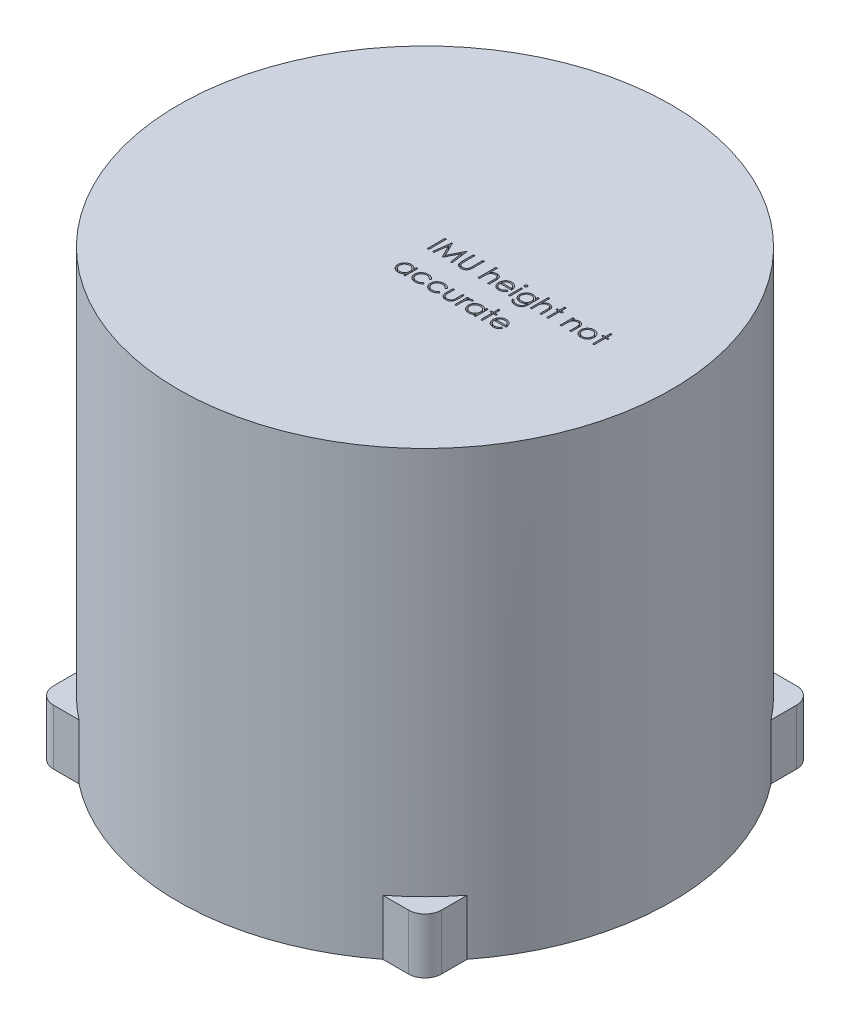
from build123d import *
from build123d.topology import SkipClean

# Parameters (mm, degrees)
BOSS_EXTRUDE1_DEPTH = 10
SKETCH2_R           = 44.45
BOSS_EXTRUDE2_DEPTH = 70
SKETCH3_W           = 0.284935897
SKETCH3_H           = 3.175
SKETCH3_H_2         = 2.320192308
CUT_EXTRUDE1_DEPTH  = 10


with BuildPart() as part:
    # Sketch1 → Boss-Extrude1 (new body)
    with BuildSketch(Plane(origin=(0, 0, 0), x_dir=(1, 0, 0), z_dir=(0, 1, 0))):
        with BuildLine():
            Line((27.400775536, 35), (32, 35))
            ThreePointArc((32, 35), (34.121320344, 34.121320344), (35, 32))
            Line((35, 32), (35, 27.400775536))
            ThreePointArc((35, 27.400775536), (44.45, 0), (35, -27.400775536))
            Line((35, -27.400775536), (35, -32))
            ThreePointArc((35, -32), (34.121320344, -34.121320344), (32, -35))
            Line((32, -35), (27.400775536, -35))
            ThreePointArc((27.400775536, -35), (0, -44.45), (-27.400775536, -35))
            Line((-27.400775536, -35), (-32, -35))
            ThreePointArc((-32, -35), (-34.121320344, -34.121320344), (-35, -32))
            Line((-35, -32), (-35, -27.400775536))
            ThreePointArc((-35, -27.400775536), (-44.45, 0), (-35, 27.400775536))
            Line((-35, 27.400775536), (-35, 32))
            ThreePointArc((-35, 32), (-34.121320344, 34.121320344), (-32, 35))
            Line((-32, 35), (-27.400775536, 35))
            ThreePointArc((-27.400775536, 35), (0, 44.45), (27.400775536, 35))
        make_face()
    extrude(amount=BOSS_EXTRUDE1_DEPTH)

    # Sketch2 → Boss-Extrude2 (add)
    with SkipClean():  # the faces are left unmerged after this step: merging them gives an invalid solid
        with BuildSketch(Plane(origin=(0, 10, 0), x_dir=(1, 0, 0), z_dir=(0, 1, 0))):
            with Locations(Location((0, 0, 0), (0, 0, 128.056656633))):
                Circle(SKETCH2_R)
        extrude(amount=BOSS_EXTRUDE2_DEPTH)

    # Sketch3 → Cut-Extrude1 (cut)
    # profile 1 of 21: a face of its own
    with SkipClean():  # the faces are left unmerged after this step: merging them gives an invalid solid
        with BuildSketch(Plane(origin=(0, 80, 0), x_dir=(1, 0, 0), z_dir=(0, 1, 0))):
            with Locations((0.549519231, 1.5875)):
                Rectangle(SKETCH3_W, SKETCH3_H)
        # profile 2 of 21: a face of its own
        with BuildSketch(Plane(origin=(0, 80, 0), x_dir=(1, 0, 0), z_dir=(0, 1, 0))):
            Polygon((1.343269231, 0), (1.762404848, 3.175), (1.803109976, 3.175), (3.113942308, 0.569871795), (4.421594551, 3.175), (4.462935697, 3.175), (4.884615385, 0), (4.598407452, 0), (4.294391026, 2.284575321), (3.14828726, 0), (3.084049479, 0), (1.93349359, 2.289663462), (1.630113181, 0), align=None)
        # profile 3 of 21: a face of its own
        with BuildSketch(Plane(origin=(0, 80, 0), x_dir=(1, 0, 0), z_dir=(0, 1, 0))):
            with BuildLine():
                Line((5.535897436, 3.175), (5.820833333, 3.175))
                Line((5.820833333, 3.175), (5.820833333, 1.272671274))
                add(Edge.make_bspline(
                    [(5.820833333, 1.272671274), (5.82079093, 1.245746607), (5.820710462, 1.19465241), (5.821247957, 1.121928309), (5.822753241, 1.057274007), (5.823702257, 1.000440284), (5.825813481, 0.951687935), (5.827535281, 0.910752832), (5.829749214, 0.877828805), (5.832409971, 0.858614679), (5.833553686, 0.850355569)],
                    knots=[0, 0, 0, 0, 1.528628734, 2.90083645, 4.128790002, 5.200304208, 6.127813768, 6.898992206, 7.526736466, 8, 8, 8, 8], degree=3))
                add(Edge.make_bspline(
                    [(5.833553686, 0.850355569), (5.838250381, 0.820558862), (5.847379128, 0.762644386), (5.870644057, 0.680177588), (5.903135647, 0.605854051), (5.94163755, 0.537354522), (5.992376419, 0.476585603), (6.053158197, 0.420604318), (6.12679803, 0.371644181), (6.208677294, 0.326875944), (6.296928902, 0.290894048), (6.387109122, 0.263685782), (6.477862396, 0.247104209), (6.538619346, 0.245184205), (6.568790064, 0.244230769)],
                    knots=[0, 0, 0, 0, 1.035780045, 2.013197591, 2.933192213, 3.817615948, 4.702609284, 5.640816605, 6.646850145, 7.73207398, 8.84249596, 9.914020372, 10.964143139, 12, 12, 12, 12], degree=3))
                add(Edge.make_bspline(
                    [(6.568790064, 0.244230769), (6.594692386, 0.245204905), (6.646347424, 0.24714755), (6.723097543, 0.259177562), (6.797846213, 0.28085879), (6.870962544, 0.308834856), (6.93949808, 0.345798742), (7.00349106, 0.388498718), (7.060608343, 0.43858287), (7.112730955, 0.494009611), (7.15811979, 0.556547858), (7.197463611, 0.624835883), (7.229690705, 0.699901362), (7.245605188, 0.752655731), (7.25378105, 0.779757612)],
                    knots=[0, 0, 0, 0, 0.994687771, 1.983630487, 2.973142513, 3.978332533, 4.983357753, 5.956394766, 6.925816176, 7.893390482, 8.871859704, 9.88551698, 10.913711441, 12, 12, 12, 12], degree=3))
                add(Edge.make_bspline(
                    [(7.25378105, 0.779757612), (7.256502592, 0.790959533), (7.262567285, 0.815921928), (7.268234247, 0.858123384), (7.274136595, 0.907915878), (7.278231955, 0.965657166), (7.282224491, 1.031153762), (7.284613064, 1.104746867), (7.285717087, 1.186169253), (7.286046089, 1.242990107), (7.286217949, 1.272671274)],
                    knots=[0, 0, 0, 0, 0.558680831, 1.244966039, 2.062412453, 2.990489873, 4.051219941, 5.244515665, 6.560634259, 8, 8, 8, 8], degree=3))
                Line((7.286217949, 1.272671274), (7.286217949, 3.175))
                Line((7.286217949, 3.175), (7.571153846, 3.175))
                Line((7.571153846, 3.175), (7.571153846, 1.257406851))
                add(Edge.make_bspline(
                    [(7.571153846, 1.257406851), (7.570923323, 1.222846179), (7.570473442, 1.155398925), (7.566572205, 1.056564478), (7.560351926, 0.962808559), (7.551563447, 0.874118566), (7.539918451, 0.790811865), (7.526968787, 0.712158253), (7.510477353, 0.638722324), (7.491215625, 0.569931488), (7.469196049, 0.504448915), (7.440674436, 0.442301815), (7.408539354, 0.381600895), (7.370426062, 0.323264254), (7.327598593, 0.267033595), (7.279110283, 0.213249934), (7.226564794, 0.161053799), (7.169088622, 0.111784089), (7.107629217, 0.066600504), (7.042369398, 0.026869668), (6.973810471, -0.006716042), (6.90213065, -0.034362059), (6.827299344, -0.055148874), (6.749314668, -0.070638479), (6.667999114, -0.079439849), (6.612695462, -0.080747886), (6.584690505, -0.081410256)],
                    knots=[0, 0, 0, 0, 1.316592851, 2.569410997, 3.76748051, 4.895814652, 5.963796859, 6.97159953, 7.931736103, 8.829262218, 9.692595152, 10.560224239, 11.431080259, 12.30701507, 13.211635791, 14.121146779, 15.063487852, 16.031507147, 17.00238618, 17.966455255, 18.938106653, 19.907068911, 20.888905087, 21.893141452, 22.933117798, 24, 24, 24, 24], degree=3))
                add(Edge.make_bspline(
                    [(6.584690505, -0.081410256), (6.554147819, -0.080698362), (6.494223178, -0.079301628), (6.405923646, -0.071298134), (6.321274339, -0.056222876), (6.239381222, -0.037027784), (6.161359228, -0.010553965), (6.086163032, 0.020377905), (6.015080515, 0.058366563), (5.946958505, 0.100633426), (5.883617476, 0.148190062), (5.825471975, 0.200024363), (5.772426006, 0.255305991), (5.725373689, 0.314633466), (5.683535458, 0.377545371), (5.647494479, 0.444219682), (5.616548893, 0.514630583), (5.600577221, 0.563573843), (5.592503005, 0.588316306)],
                    knots=[0, 0, 0, 0, 1.13879206, 2.234305948, 3.301075583, 4.341971843, 5.366689343, 6.369221514, 7.369726634, 8.367512178, 9.355451585, 10.318319045, 11.268648973, 12.207971039, 13.137398894, 14.081662264, 15.030215811, 16, 16, 16, 16], degree=3))
                add(Edge.make_bspline(
                    [(5.592503005, 0.588316306), (5.587806583, 0.605218713), (5.577619939, 0.64188041), (5.566711276, 0.70255601), (5.557540895, 0.772419543), (5.548917995, 0.851475789), (5.543829869, 0.939786025), (5.53936905, 1.03731197), (5.53586601, 1.14417155), (5.535886668, 1.218606718), (5.535897436, 1.257406851)],
                    knots=[0, 0, 0, 0, 0.625038921, 1.35572334, 2.194682327, 3.136881307, 4.189498639, 5.346923369, 6.617055217, 8, 8, 8, 8], degree=3))
                Line((5.535897436, 1.257406851), (5.535897436, 3.175))
            make_face()
        # profile 4 of 21: a face of its own
        with BuildSketch(Plane(origin=(0, 80, 0), x_dir=(1, 0, 0), z_dir=(0, 1, 0))):
            with BuildLine():
                Line((9.525, 3.256410256), (9.809935897, 3.256410256))
                Line((9.809935897, 3.256410256), (9.809935897, 1.881976162))
                add(Edge.make_bspline(
                    [(9.809935897, 1.881976162), (9.840522307, 1.920206774), (9.900075613, 1.994643735), (10.000311376, 2.09176353), (10.103245667, 2.175945136), (10.212433745, 2.242956194), (10.325872431, 2.295893915), (10.444040166, 2.333438423), (10.566958904, 2.356526204), (10.650438861, 2.359427626), (10.692728365, 2.360897436)],
                    knots=[0, 0, 0, 0, 1.125788106, 2.19196713, 3.20547328, 4.180437432, 5.132270164, 6.079753143, 7.027236121, 8, 8, 8, 8], degree=3))
                add(Edge.make_bspline(
                    [(10.692728365, 2.360897436), (10.735663793, 2.359314081), (10.819698782, 2.356215074), (10.942055537, 2.331710079), (11.056320045, 2.289838689), (11.162152631, 2.232537173), (11.257243607, 2.16116968), (11.341471607, 2.078772513), (11.410270046, 1.98327403), (11.457077816, 1.895048714), (11.487533693, 1.816545701), (11.506812136, 1.749202579), (11.523158123, 1.674161987), (11.537400026, 1.591462551), (11.546891989, 1.500707288), (11.554516179, 1.402305643), (11.559937676, 1.296263257), (11.560147775, 1.222857031), (11.56025641, 1.184900841)],
                    knots=[0, 0, 0, 0, 1.235656852, 2.418478516, 3.575258207, 4.727955599, 5.870717718, 6.98870536, 8.107142894, 9.245821548, 9.854588956, 10.528768408, 11.260415777, 12.065282286, 12.943670737, 13.886611085, 14.907229059, 16, 16, 16, 16], degree=3))
                Line((11.56025641, 1.184900841), (11.56025641, 0))
                Line((11.56025641, 0), (11.275320513, 0))
                Line((11.275320513, 0), (11.275320513, 1.09140625))
                add(Edge.make_bspline(
                    [(11.275320513, 1.09140625), (11.275147881, 1.122995386), (11.274817665, 1.183420027), (11.273726059, 1.269930711), (11.271289278, 1.348395062), (11.267351529, 1.418561611), (11.263210143, 1.480528179), (11.257510277, 1.534204779), (11.25087885, 1.579665132), (11.244920027, 1.607028759), (11.242247596, 1.619300881)],
                    knots=[0, 0, 0, 0, 1.430932559, 2.737130458, 3.918967929, 4.986496826, 5.920444988, 6.731744033, 7.431208747, 8, 8, 8, 8], degree=3))
                add(Edge.make_bspline(
                    [(11.242247596, 1.619300881), (11.231884174, 1.655309249), (11.211960555, 1.724535126), (11.165652747, 1.818571741), (11.107814215, 1.898749328), (11.037195628, 1.96398586), (10.955046255, 2.015159185), (10.86083043, 2.050599245), (10.755434883, 2.072595393), (10.681183905, 2.074808189), (10.642482973, 2.075961538)],
                    knots=[0, 0, 0, 0, 1.090059168, 2.095632401, 3.037101401, 3.955032261, 4.878929692, 5.839099886, 6.873700383, 8, 8, 8, 8], degree=3))
                add(Edge.make_bspline(
                    [(10.642482973, 2.075961538), (10.619561493, 2.075529896), (10.574200476, 2.074675687), (10.506937044, 2.06609965), (10.441687107, 2.052085456), (10.377822275, 2.033122053), (10.316696088, 2.007317887), (10.256526822, 1.977445501), (10.199019218, 1.940880156), (10.143152084, 1.899853924), (10.091156893, 1.854433499), (10.042781581, 1.806493761), (9.999657516, 1.755444329), (9.960588151, 1.702104224), (9.926862135, 1.645741811), (9.897422553, 1.586900608), (9.872443743, 1.525503233), (9.860031586, 1.482890142), (9.853821114, 1.46156851)],
                    knots=[0, 0, 0, 0, 1.024319606, 2.027102035, 3.025350316, 4.005802111, 5.00026367, 5.987881639, 7.005602596, 8.042517216, 9.083927026, 10.089214625, 11.084353441, 12.06828073, 13.041928858, 14.016821737, 15.00770877, 16, 16, 16, 16], degree=3))
                add(Edge.make_bspline(
                    [(9.853821114, 1.46156851), (9.850247491, 1.446128076), (9.842460126, 1.412481469), (9.834010241, 1.356987618), (9.826446668, 1.292502124), (9.820052627, 1.219122793), (9.81613097, 1.136580738), (9.81190528, 1.045439225), (9.810332282, 0.945127349), (9.810071974, 0.875372139), (9.809935897, 0.838907252)],
                    knots=[0, 0, 0, 0, 0.607992626, 1.324890765, 2.152360218, 3.099583803, 4.150613268, 5.323148443, 6.60066238, 8, 8, 8, 8], degree=3))
                Line((9.809935897, 0.838907252), (9.809935897, 0))
                Line((9.809935897, 0), (9.525, 0))
                Line((9.525, 0), (9.525, 3.256410256))
            make_face()
        # profile 5 of 21: a face of its own
        with BuildSketch(Plane(origin=(0, 80, 0), x_dir=(1, 0, 0), z_dir=(0, 1, 0))):
            with BuildLine():
                Line((14.11577524, 0.732692308), (14.368910256, 0.599764623))
                add(Edge.make_bspline(
                    [(14.368910256, 0.599764623), (14.348738488, 0.563983887), (14.309492214, 0.494368744), (14.242000107, 0.398726985), (14.171250156, 0.312686557), (14.094048699, 0.238546085), (14.01270549, 0.1739109), (13.926769439, 0.117361587), (13.835793155, 0.069175501), (13.739772333, 0.028578565), (13.637900597, -0.002635762), (13.529931079, -0.024683162), (13.415656937, -0.038311413), (13.337328616, -0.039894505), (13.297220553, -0.040705128)],
                    knots=[0, 0, 0, 0, 1.120438281, 2.179929193, 3.190490725, 4.156257408, 5.095198341, 6.022838206, 6.959905092, 7.901321166, 8.864066838, 9.862729781, 10.905609505, 12, 12, 12, 12], degree=3))
                add(Edge.make_bspline(
                    [(13.297220553, -0.040705128), (13.252641759, -0.039664476), (13.165681447, -0.037634466), (13.039098962, -0.020133445), (12.919919061, 0.008416481), (12.808148444, 0.048299508), (12.704060829, 0.100394295), (12.60744934, 0.163857539), (12.517805913, 0.238363227), (12.43795538, 0.324556715), (12.366069858, 0.416796776), (12.30263715, 0.5129139), (12.249607909, 0.612666254), (12.206470898, 0.7154188), (12.171632199, 0.820523904), (12.147350975, 0.928937878), (12.133353989, 1.040367301), (12.131209099, 1.115748455), (12.130128205, 1.153735978)],
                    knots=[0, 0, 0, 0, 1.145258523, 2.234067595, 3.276747158, 4.290159414, 5.277019952, 6.260822364, 7.254936242, 8.264827045, 9.274100331, 10.257902744, 11.220704747, 12.172965371, 13.118907548, 14.062713208, 15.023725156, 16, 16, 16, 16], degree=3))
                add(Edge.make_bspline(
                    [(12.130128205, 1.153735978), (12.131088998, 1.189382002), (12.132993161, 1.260027716), (12.144995376, 1.364590031), (12.166266327, 1.466215842), (12.19545485, 1.564989591), (12.233147766, 1.660745898), (12.279259851, 1.753543042), (12.333862936, 1.843282276), (12.37602029, 1.899890833), (12.397255609, 1.928405449)],
                    knots=[0, 0, 0, 0, 1.024358464, 2.0301432, 3.019427413, 4.004406732, 4.986367066, 5.972626655, 6.978780325, 8, 8, 8, 8], degree=3))
                add(Edge.make_bspline(
                    [(12.397255609, 1.928405449), (12.426019007, 1.962757924), (12.482634651, 2.030374674), (12.578389345, 2.119218727), (12.682075952, 2.193644152), (12.79239507, 2.25533634), (12.910628871, 2.302211719), (13.035188014, 2.337143598), (13.167490796, 2.356717936), (13.257937675, 2.359482757), (13.304216747, 2.360897436)],
                    knots=[0, 0, 0, 0, 1.030682036, 2.02871468, 2.997146059, 3.962720338, 4.930598197, 5.918074684, 6.934738563, 8, 8, 8, 8], degree=3))
                add(Edge.make_bspline(
                    [(13.304216747, 2.360897436), (13.351794217, 2.35966912), (13.445130369, 2.357259445), (13.581230936, 2.334919842), (13.710009586, 2.299493596), (13.831414786, 2.249461229), (13.945458846, 2.18490935), (14.051400476, 2.104952108), (14.151051491, 2.012044272), (14.209025702, 1.940594789), (14.238526643, 1.904236779)],
                    knots=[0, 0, 0, 0, 1.056321875, 2.072262726, 3.055038591, 4.01806755, 4.982017516, 5.957941055, 6.960871419, 8, 8, 8, 8], degree=3))
                add(Edge.make_bspline(
                    [(14.238526643, 1.904236779), (14.258598937, 1.876837816), (14.298609918, 1.822222265), (14.34872693, 1.733167001), (14.392231138, 1.639993819), (14.42700461, 1.541196621), (14.455161872, 1.437946002), (14.475533414, 1.329503836), (14.48748014, 1.215902417), (14.489828458, 1.138499042), (14.491025641, 1.099038462)],
                    knots=[0, 0, 0, 0, 0.94817472, 1.890038105, 2.849395472, 3.817997239, 4.812318967, 5.836947057, 6.897266129, 8, 8, 8, 8], degree=3))
                Line((14.491025641, 1.099038462), (12.415064103, 1.099038462))
                add(Edge.make_bspline(
                    [(12.415064103, 1.099038462), (12.416460746, 1.068467326), (12.419207188, 1.008350421), (12.432011639, 0.920384068), (12.452194455, 0.836588251), (12.480559962, 0.757591491), (12.5149106, 0.682362018), (12.556989072, 0.611457885), (12.607189953, 0.545202048), (12.66318398, 0.483001859), (12.725511131, 0.427611026), (12.791081909, 0.378034057), (12.860835357, 0.336481837), (12.934221476, 0.302754366), (13.011121595, 0.276350779), (13.091559943, 0.258327828), (13.175378235, 0.246256381), (13.232515293, 0.244914113), (13.261603566, 0.244230769)],
                    knots=[0, 0, 0, 0, 1.094153842, 2.151609401, 3.174256925, 4.172055639, 5.149267565, 6.128595816, 7.11444997, 8.118368179, 9.117203808, 10.09244225, 11.054858984, 12.015122123, 12.976791628, 13.957293641, 14.960065497, 16, 16, 16, 16], degree=3))
                add(Edge.make_bspline(
                    [(13.261603566, 0.244230769), (13.290043535, 0.244782363), (13.346473891, 0.245876832), (13.430512383, 0.256519351), (13.513188954, 0.273728102), (13.594161417, 0.297214021), (13.671786399, 0.325858737), (13.743673434, 0.360423472), (13.809786201, 0.398659314), (13.87157802, 0.442392376), (13.93151385, 0.495921231), (13.990970249, 0.56271935), (14.054721213, 0.641720179), (14.094626057, 0.701179461), (14.11577524, 0.732692308)],
                    knots=[0, 0, 0, 0, 0.99110716, 1.966546729, 2.947904876, 3.932708344, 4.903319531, 5.828989031, 6.710028674, 7.56322171, 8.463672341, 9.504779593, 10.677557249, 12, 12, 12, 12], degree=3))
            make_face()
            with BuildLine():
                add(Edge.make_bspline(
                    [(14.206089744, 1.383974359), (14.195660663, 1.421768537), (14.175588039, 1.494510165), (14.133645052, 1.595240115), (14.086408725, 1.68476414), (14.030509012, 1.762397092), (13.967173454, 1.831343136), (13.894016752, 1.891594282), (13.811978477, 1.945494398), (13.721482685, 1.990989879), (13.625650495, 2.02971568), (13.525314878, 2.055682749), (13.422936742, 2.073471405), (13.353690639, 2.075127947), (13.318845152, 2.075961538)],
                    knots=[0, 0, 0, 0, 1.154881502, 2.222775134, 3.210006277, 4.132804581, 5.035138423, 5.962687519, 6.919655026, 7.923214229, 8.944639381, 9.960483929, 10.97369054, 12, 12, 12, 12], degree=3))
                add(Edge.make_bspline(
                    [(13.318845152, 2.075961538), (13.290406733, 2.075406665), (13.234189957, 2.074309797), (13.151366845, 2.063904751), (13.071828833, 2.046705463), (12.994989036, 2.023151538), (12.921854391, 1.991756592), (12.850920566, 1.954941807), (12.783991206, 1.910000514), (12.74213446, 1.875747838), (12.720988582, 1.85844351)],
                    knots=[0, 0, 0, 0, 1.04873581, 2.073130211, 3.073294108, 4.04793562, 5.032784715, 6.005352987, 6.992311501, 8, 8, 8, 8], degree=3))
                add(Edge.make_bspline(
                    [(12.720988582, 1.85844351), (12.70584539, 1.844750809), (12.675199261, 1.81704012), (12.63425036, 1.769297911), (12.595043217, 1.717816137), (12.559361974, 1.660625203), (12.52663445, 1.598376353), (12.496009327, 1.531594641), (12.468444511, 1.459773302), (12.452935897, 1.409724017), (12.444956931, 1.383974359)],
                    knots=[0, 0, 0, 0, 0.879870761, 1.780643979, 2.707998968, 3.669668524, 4.684282772, 5.740141944, 6.837334558, 8, 8, 8, 8], degree=3))
                Line((12.444956931, 1.383974359), (14.206089744, 1.383974359))
            make_face(mode=Mode.SUBTRACT)
        # profile 6 of 21: a face of its own
        with BuildSketch(Plane(origin=(0, 80, 0), x_dir=(1, 0, 0), z_dir=(0, 1, 0))):
            with BuildLine():
                add(Edge.make_bspline(
                    [(15.161388221, 3.297115385), (15.179069629, 3.296295189), (15.213693222, 3.294689089), (15.2637614, 3.280935463), (15.30935169, 3.257622177), (15.349790062, 3.226344181), (15.384489987, 3.189560043), (15.408783918, 3.146687593), (15.42439802, 3.100370114), (15.426283566, 3.06806214), (15.42724359, 3.05161258)],
                    knots=[0, 0, 0, 0, 1.055194115, 2.066272739, 3.074728998, 4.095836921, 5.109056067, 6.073838105, 7.019297344, 8, 8, 8, 8], degree=3))
                add(Edge.make_bspline(
                    [(15.42724359, 3.05161258), (15.426261916, 3.03559003), (15.424321264, 3.003915346), (15.408795978, 2.958400839), (15.384282948, 2.916124096), (15.349812313, 2.879411381), (15.309345794, 2.848150675), (15.263762966, 2.824832805), (15.21369281, 2.811080395), (15.17906949, 2.809474127), (15.161388221, 2.808653846)],
                    knots=[0, 0, 0, 0, 0.96129708, 1.900370562, 2.859976407, 3.87933698, 4.906634145, 5.921202961, 6.938410037, 8, 8, 8, 8], degree=3))
                add(Edge.make_bspline(
                    [(15.161388221, 2.808653846), (15.143909143, 2.809442807), (15.109888401, 2.810978415), (15.060569908, 2.825102646), (15.01536835, 2.848158655), (14.974851111, 2.879206694), (14.941078007, 2.916349565), (14.916495955, 2.958375039), (14.901006525, 3.003921915), (14.899061041, 3.035592237), (14.898076923, 3.05161258)],
                    knots=[0, 0, 0, 0, 1.054934014, 2.053291228, 3.073705704, 4.106921865, 5.123545215, 6.088680038, 7.033164197, 8, 8, 8, 8], degree=3))
                add(Edge.make_bspline(
                    [(14.898076923, 3.05161258), (14.89903948, 3.068059851), (14.900930003, 3.100363328), (14.916507566, 3.146713822), (14.940873248, 3.189332756), (14.974873474, 3.226548745), (15.015362399, 3.257614247), (15.060571446, 3.280665637), (15.109887995, 3.294791066), (15.143909005, 3.296326509), (15.161388221, 3.297115385)],
                    knots=[0, 0, 0, 0, 0.98631895, 1.937192651, 2.907499808, 3.917963147, 4.944918757, 5.95915025, 6.951458133, 8, 8, 8, 8], degree=3))
            make_face()
        # profile 7 of 21: a face of its own
        with BuildSketch(Plane(origin=(0, 80, 0), x_dir=(1, 0, 0), z_dir=(0, 1, 0))):
            with Locations((15.162660257, 1.160096154)):
                Rectangle(SKETCH3_W, SKETCH3_H_2)
        # profile 8 of 21: a face of its own
        with BuildSketch(Plane(origin=(0, 80, 0), x_dir=(1, 0, 0), z_dir=(0, 1, 0))):
            with BuildLine():
                Line((18.032371795, 2.320192308), (18.317307692, 2.320192308))
                Line((18.317307692, 2.320192308), (18.317307692, 0.478921274))
                add(Edge.make_bspline(
                    [(18.317307692, 0.478921274), (18.317056375, 0.439698599), (18.316571272, 0.363989388), (18.313077891, 0.254516949), (18.305711277, 0.153401285), (18.297357687, 0.060181236), (18.285341023, -0.024711106), (18.270666747, -0.101529056), (18.254124381, -0.170346331), (18.239591755, -0.212732436), (18.232717348, -0.232782452)],
                    knots=[0, 0, 0, 0, 1.307562039, 2.523909702, 3.650326591, 4.686913197, 5.643429486, 6.506965704, 7.293745905, 8, 8, 8, 8], degree=3))
                add(Edge.make_bspline(
                    [(18.232717348, -0.232782452), (18.22256711, -0.258844595), (18.202570119, -0.31018964), (18.165118152, -0.382973631), (18.123177396, -0.451504999), (18.07527413, -0.51540183), (18.021624972, -0.574343358), (17.963493904, -0.629610128), (17.899748802, -0.680032909), (17.830426113, -0.724741714), (17.75712386, -0.765007113), (17.679884182, -0.799883642), (17.599142627, -0.830260993), (17.514140718, -0.853014672), (17.426211148, -0.872731169), (17.334319907, -0.885562419), (17.23900387, -0.894295536), (17.174192704, -0.895103105), (17.141311098, -0.895512821)],
                    knots=[0, 0, 0, 0, 0.981931301, 1.934503488, 2.87077864, 3.801706999, 4.735015492, 5.667491629, 6.616593066, 7.585388521, 8.561939025, 9.551802639, 10.560317337, 11.588439944, 12.640189604, 13.723962949, 14.845264515, 16, 16, 16, 16], degree=3))
                add(Edge.make_bspline(
                    [(17.141311098, -0.895512821), (17.093337089, -0.894735866), (16.999630959, -0.893218264), (16.863010716, -0.875537219), (16.733257791, -0.850541467), (16.612086677, -0.812708686), (16.500263089, -0.766410845), (16.398550716, -0.713256852), (16.30786264, -0.652306551), (16.226107594, -0.582909577), (16.152319152, -0.500392523), (16.082897967, -0.403147857), (16.01607697, -0.289694322), (15.976916848, -0.206425218), (15.956410256, -0.162820513)],
                    knots=[0, 0, 0, 0, 1.157897085, 2.2616841, 3.32207898, 4.345638746, 5.321241055, 6.241986252, 7.112515963, 7.955008012, 8.825025602, 9.77857164, 10.836726669, 12, 12, 12, 12], degree=3))
                Line((15.956410256, -0.162820513), (16.241346154, -0.162820513))
                add(Edge.make_bspline(
                    [(16.241346154, -0.162820513), (16.264262587, -0.199202272), (16.309061391, -0.27032413), (16.392834656, -0.362411064), (16.484643252, -0.441108759), (16.587585536, -0.504527819), (16.702089838, -0.552343129), (16.828225046, -0.586429291), (16.96701756, -0.606836619), (17.063644797, -0.60929615), (17.11396234, -0.610576923)],
                    knots=[0, 0, 0, 0, 0.997731894, 1.950442991, 2.880492273, 3.800895997, 4.748200782, 5.754801363, 6.83083817, 8, 8, 8, 8], degree=3))
                add(Edge.make_bspline(
                    [(17.11396234, -0.610576923), (17.163643733, -0.609279574), (17.259424487, -0.606778414), (17.397157047, -0.586420184), (17.522882455, -0.552335711), (17.635876352, -0.50461239), (17.734805513, -0.446146664), (17.820087819, -0.38083231), (17.889161918, -0.307189543), (17.935619395, -0.239351762), (17.964497941, -0.178914159), (17.982887756, -0.126887161), (17.997832, -0.068056336), (18.010332281, -0.002618919), (18.020647324, 0.069518585), (18.027181367, 0.148521115), (18.031903782, 0.234209124), (18.032212183, 0.293620756), (18.032371795, 0.32436899)],
                    knots=[0, 0, 0, 0, 1.570740765, 3.028230971, 4.391408896, 5.680370741, 6.894727393, 8.017376726, 9.065722033, 10.075533815, 10.603371122, 11.180248986, 11.817768598, 12.521299649, 13.286540596, 14.121245857, 15.027658897, 16, 16, 16, 16], degree=3))
                Line((18.032371795, 0.32436899), (18.032371795, 0.444576322))
                add(Edge.make_bspline(
                    [(18.032371795, 0.444576322), (18.003451067, 0.410157687), (17.946118318, 0.341925831), (17.8471061, 0.252516346), (17.738959326, 0.175512499), (17.621862113, 0.112358452), (17.498682779, 0.061847446), (17.37075547, 0.026520617), (17.239226963, 0.003696993), (17.150098227, 0.001241071), (17.105058093, 0)],
                    knots=[0, 0, 0, 0, 1.012485704, 2.007162095, 2.997754123, 3.998611389, 4.999708251, 5.992315798, 6.98544096, 8, 8, 8, 8], degree=3))
                add(Edge.make_bspline(
                    [(17.105058093, 0), (17.07853662, 0.000467203), (17.025807528, 0.001396079), (16.947471436, 0.00952297), (16.870291324, 0.021314686), (16.794447193, 0.038624277), (16.719829601, 0.060841772), (16.646561857, 0.088615528), (16.574050729, 0.120016385), (16.503614264, 0.157003142), (16.435953988, 0.198153235), (16.371580241, 0.242729229), (16.310830209, 0.290497819), (16.254282108, 0.341930043), (16.202010113, 0.396951462), (16.153311176, 0.454975542), (16.108990583, 0.516812515), (16.068138865, 0.581334826), (16.032708087, 0.648972236), (16.001607264, 0.718258079), (15.974565876, 0.789044209), (15.953007261, 0.861567616), (15.936541608, 0.935782578), (15.924285902, 1.011567514), (15.917334529, 1.089155794), (15.916250562, 1.141426589), (15.915705128, 1.167728365)],
                    knots=[0, 0, 0, 0, 1.028754217, 2.045334182, 3.052854819, 4.056607503, 5.061168794, 6.071104265, 7.095078842, 8.125279047, 9.155117945, 10.165957491, 11.161587969, 12.151493252, 13.128948131, 14.104219989, 15.088194871, 16.07871515, 17.064853787, 18.047899887, 19.02414258, 20.002704429, 20.980574569, 21.971845993, 22.979467364, 24, 24, 24, 24], degree=3))
                add(Edge.make_bspline(
                    [(15.915705128, 1.167728365), (15.916176086, 1.194038317), (15.917116178, 1.246556317), (15.925235995, 1.324461188), (15.936818567, 1.40132289), (15.9551499, 1.476349176), (15.977213903, 1.550394486), (16.004540286, 1.6229119), (16.037395875, 1.693923505), (16.074597577, 1.763481887), (16.116402432, 1.830653652), (16.162242611, 1.894449967), (16.212173454, 1.95440138), (16.265506121, 2.011112705), (16.322891812, 2.064036774), (16.384300841, 2.113045135), (16.449127882, 2.158959288), (16.517573852, 2.200788858), (16.588582625, 2.237784181), (16.66035016, 2.271541323), (16.73382713, 2.298332988), (16.807643648, 2.321939657), (16.883099714, 2.338663013), (16.959270135, 2.351564618), (17.036415685, 2.359424758), (17.088080096, 2.36040591), (17.11396234, 2.360897436)],
                    knots=[0, 0, 0, 0, 1.008818848, 2.013730394, 3.001654427, 3.987803273, 4.973046549, 5.963777569, 6.957074694, 7.972068341, 8.987420212, 9.989399531, 10.982630087, 11.977756091, 12.973280677, 13.973972381, 14.989194003, 16.018387222, 17.047741039, 18.059210846, 19.057554164, 20.045176975, 21.029480261, 22.018708529, 23.007435371, 24, 24, 24, 24], degree=3))
                add(Edge.make_bspline(
                    [(17.11396234, 2.360897436), (17.156644263, 2.359666739), (17.240927947, 2.357236492), (17.364962499, 2.33816731), (17.484652959, 2.307765312), (17.600674731, 2.264208276), (17.713972928, 2.204745027), (17.824174144, 2.126419638), (17.931597216, 2.028529545), (17.997889248, 1.953460875), (18.032371795, 1.914413061)],
                    knots=[0, 0, 0, 0, 0.96728863, 1.910097829, 2.838038873, 3.762875196, 4.71315279, 5.730631239, 6.819562287, 8, 8, 8, 8], degree=3))
                Line((18.032371795, 1.914413061), (18.032371795, 2.320192308))
            make_face()
            with BuildLine():
                add(Edge.make_bspline(
                    [(17.136858974, 2.075961538), (17.095193264, 2.074545429), (17.012703994, 2.071741833), (16.891792426, 2.047807129), (16.775064065, 2.010300491), (16.664750569, 1.95664969), (16.561420548, 1.891249917), (16.469731247, 1.812019799), (16.389535358, 1.721535749), (16.32169655, 1.620615882), (16.267693096, 1.511738532), (16.229462994, 1.396975223), (16.20474333, 1.278180337), (16.20201496, 1.197106618), (16.200641026, 1.156280048)],
                    knots=[0, 0, 0, 0, 1.026226791, 2.031711442, 3.026614839, 4.04107745, 5.047145931, 6.032893242, 7.017642609, 8.019221815, 9.021877557, 10.003543541, 10.994637589, 12, 12, 12, 12], degree=3))
                add(Edge.make_bspline(
                    [(16.200641026, 1.156280048), (16.201299391, 1.125497722), (16.202594202, 1.064957889), (16.215043448, 0.976114227), (16.235164752, 0.891495657), (16.263682789, 0.81109706), (16.299018448, 0.734457282), (16.343461528, 0.662104262), (16.395759195, 0.593973564), (16.455502116, 0.530569103), (16.521339262, 0.47281951), (16.592748821, 0.422075716), (16.669633941, 0.380573277), (16.75010369, 0.344704088), (16.83611059, 0.318506648), (16.926415832, 0.298514327), (17.0216583, 0.287076383), (17.086584092, 0.285658702), (17.119686498, 0.284935897)],
                    knots=[0, 0, 0, 0, 1.039728707, 2.044842319, 3.024901384, 3.974314358, 4.923051295, 5.871625912, 6.837440708, 7.820715446, 8.810779094, 9.792721783, 10.773906224, 11.758876063, 12.764959493, 13.806266761, 14.881525401, 16, 16, 16, 16], degree=3))
                add(Edge.make_bspline(
                    [(17.119686498, 0.284935897), (17.153217908, 0.285632228), (17.218788223, 0.286993896), (17.314556144, 0.298699213), (17.40530013, 0.31758772), (17.490936976, 0.344405607), (17.571790021, 0.378624624), (17.646950993, 0.421928556), (17.718031485, 0.471244862), (17.782761942, 0.528768618), (17.841294578, 0.592164292), (17.892303917, 0.661147875), (17.935769167, 0.734681346), (17.971762482, 0.812756415), (17.999240931, 0.895979835), (18.017673081, 0.984143558), (18.030560628, 1.0768252), (18.031758895, 1.140333016), (18.032371795, 1.172816506)],
                    knots=[0, 0, 0, 0, 1.121943988, 2.193949579, 3.223793937, 4.220241907, 5.192961521, 6.155822191, 7.11847367, 8.083710714, 9.04790392, 10.001595906, 10.949595423, 11.902125208, 12.873731292, 13.87582262, 14.913508608, 16, 16, 16, 16], degree=3))
                add(Edge.make_bspline(
                    [(18.032371795, 1.172816506), (18.031156615, 1.21510556), (18.028782581, 1.297723509), (18.006378731, 1.418107506), (17.970256112, 1.531290517), (17.919595129, 1.636914581), (17.85611145, 1.73386053), (17.779647608, 1.820332874), (17.691522281, 1.896442937), (17.591988661, 1.959850584), (17.484902765, 2.011072799), (17.372851394, 2.049500978), (17.256000904, 2.07126725), (17.176801518, 2.07438777), (17.136858974, 2.075961538)],
                    knots=[0, 0, 0, 0, 1.070913519, 2.092188694, 3.091357305, 4.074328408, 5.051968682, 6.018948707, 6.99050112, 7.9935919, 9.000589572, 9.992915277, 10.987769056, 12, 12, 12, 12], degree=3))
            make_face(mode=Mode.SUBTRACT)
        # profile 9 of 21: a face of its own
        with BuildSketch(Plane(origin=(0, 80, 0), x_dir=(1, 0, 0), z_dir=(0, 1, 0))):
            with BuildLine():
                Line((18.968589744, 3.256410256), (19.253525641, 3.256410256))
                Line((19.253525641, 3.256410256), (19.253525641, 1.881976162))
                add(Edge.make_bspline(
                    [(19.253525641, 1.881976162), (19.28411205, 1.920206774), (19.343665357, 1.994643735), (19.44390112, 2.09176353), (19.546835411, 2.175945136), (19.656023488, 2.242956194), (19.769462175, 2.295893915), (19.887629909, 2.333438423), (20.010548647, 2.356526204), (20.094028605, 2.359427626), (20.136318109, 2.360897436)],
                    knots=[0, 0, 0, 0, 1.125788106, 2.19196713, 3.20547328, 4.180437432, 5.132270164, 6.079753143, 7.027236121, 8, 8, 8, 8], degree=3))
                add(Edge.make_bspline(
                    [(20.136318109, 2.360897436), (20.179253537, 2.359314081), (20.263288526, 2.356215074), (20.385645281, 2.331710079), (20.499909789, 2.289838689), (20.605742375, 2.232537173), (20.70083335, 2.16116968), (20.785061351, 2.078772513), (20.853859789, 1.98327403), (20.90066756, 1.895048714), (20.931123437, 1.816545701), (20.950401879, 1.749202579), (20.966747866, 1.674161987), (20.98098977, 1.591462551), (20.990481733, 1.500707288), (20.998105922, 1.402305643), (21.00352742, 1.296263257), (21.003737518, 1.222857031), (21.003846154, 1.184900841)],
                    knots=[0, 0, 0, 0, 1.235656852, 2.418478516, 3.575258207, 4.727955599, 5.870717718, 6.98870536, 8.107142894, 9.245821548, 9.854588956, 10.528768408, 11.260415777, 12.065282286, 12.943670737, 13.886611085, 14.907229059, 16, 16, 16, 16], degree=3))
                Line((21.003846154, 1.184900841), (21.003846154, 0))
                Line((21.003846154, 0), (20.718910256, 0))
                Line((20.718910256, 0), (20.718910256, 1.09140625))
                add(Edge.make_bspline(
                    [(20.718910256, 1.09140625), (20.718737624, 1.122995386), (20.718407408, 1.183420027), (20.717315803, 1.269930711), (20.714879022, 1.348395062), (20.710941273, 1.418561611), (20.706799887, 1.480528179), (20.70110002, 1.534204779), (20.694468594, 1.579665132), (20.688509771, 1.607028759), (20.68583734, 1.619300881)],
                    knots=[0, 0, 0, 0, 1.430932559, 2.737130458, 3.918967929, 4.986496826, 5.920444988, 6.731744033, 7.431208747, 8, 8, 8, 8], degree=3))
                add(Edge.make_bspline(
                    [(20.68583734, 1.619300881), (20.675473917, 1.655309249), (20.655550298, 1.724535126), (20.60924249, 1.818571741), (20.551403959, 1.898749328), (20.480785372, 1.96398586), (20.398635999, 2.015159185), (20.304420174, 2.050599245), (20.199024626, 2.072595393), (20.124773648, 2.074808189), (20.086072716, 2.075961538)],
                    knots=[0, 0, 0, 0, 1.090059168, 2.095632401, 3.037101401, 3.955032261, 4.878929692, 5.839099886, 6.873700383, 8, 8, 8, 8], degree=3))
                add(Edge.make_bspline(
                    [(20.086072716, 2.075961538), (20.063151236, 2.075529896), (20.01779022, 2.074675687), (19.950526787, 2.06609965), (19.885276851, 2.052085456), (19.821412018, 2.033122053), (19.760285832, 2.007317887), (19.700116566, 1.977445501), (19.642608962, 1.940880156), (19.586741828, 1.899853924), (19.534746637, 1.854433499), (19.486371325, 1.806493761), (19.443247259, 1.755444329), (19.404177895, 1.702104224), (19.370451878, 1.645741811), (19.341012297, 1.586900608), (19.316033486, 1.525503233), (19.30362133, 1.482890142), (19.297410857, 1.46156851)],
                    knots=[0, 0, 0, 0, 1.024319606, 2.027102035, 3.025350316, 4.005802111, 5.00026367, 5.987881639, 7.005602596, 8.042517216, 9.083927026, 10.089214625, 11.084353441, 12.06828073, 13.041928858, 14.016821737, 15.00770877, 16, 16, 16, 16], degree=3))
                add(Edge.make_bspline(
                    [(19.297410857, 1.46156851), (19.293837234, 1.446128076), (19.286049869, 1.412481469), (19.277599985, 1.356987618), (19.270036412, 1.292502124), (19.26364237, 1.219122793), (19.259720713, 1.136580738), (19.255495024, 1.045439225), (19.253922025, 0.945127349), (19.253661718, 0.875372139), (19.253525641, 0.838907252)],
                    knots=[0, 0, 0, 0, 0.607992626, 1.324890765, 2.152360218, 3.099583803, 4.150613268, 5.323148443, 6.60066238, 8, 8, 8, 8], degree=3))
                Line((19.253525641, 0.838907252), (19.253525641, 0))
                Line((19.253525641, 0), (18.968589744, 0))
                Line((18.968589744, 0), (18.968589744, 3.256410256))
            make_face()
        # profile 10 of 21: a face of its own
        with BuildSketch(Plane(origin=(0, 80, 0), x_dir=(1, 0, 0), z_dir=(0, 1, 0))):
            Polygon((21.940064103, 3.256410256), (22.225, 3.256410256), (22.225, 2.320192308), (22.632051282, 2.320192308), (22.632051282, 2.03525641), (22.225, 2.03525641), (22.225, 0), (21.940064103, 0), (21.940064103, 2.03525641), (21.533012821, 2.03525641), (21.533012821, 2.320192308), (21.940064103, 2.320192308), align=None)
        # profile 11 of 21: a face of its own
        with BuildSketch(Plane(origin=(0, 80, 0), x_dir=(1, 0, 0), z_dir=(0, 1, 0))):
            with BuildLine():
                Line((24.341666667, 2.320192308), (24.626602564, 2.320192308))
                Line((24.626602564, 2.320192308), (24.626602564, 1.901692708))
                add(Edge.make_bspline(
                    [(24.626602564, 1.901692708), (24.65702599, 1.939650035), (24.71606371, 2.013307553), (24.814383784, 2.11011836), (24.918291465, 2.189897243), (25.027150425, 2.253491399), (25.141108442, 2.301430838), (25.259470872, 2.33605279), (25.382946356, 2.356812599), (25.466915523, 2.359525165), (25.509395032, 2.360897436)],
                    knots=[0, 0, 0, 0, 1.12780773, 2.188550248, 3.19190651, 4.159438251, 5.104880172, 6.052711206, 7.014878035, 8, 8, 8, 8], degree=3))
                add(Edge.make_bspline(
                    [(25.509395032, 2.360897436), (25.552330679, 2.359314294), (25.636366096, 2.356215704), (25.758719766, 2.331707706), (25.87299563, 2.289847367), (25.978786227, 2.232504989), (26.074151628, 2.161197688), (26.157903457, 2.078123558), (26.227175832, 1.982568682), (26.273619154, 1.893919819), (26.304213134, 1.815280699), (26.323473898, 1.74792829), (26.339830574, 1.67289111), (26.354010802, 1.590395911), (26.363605754, 1.499864696), (26.371173404, 1.401668575), (26.376596934, 1.295839357), (26.376812114, 1.222645059), (26.376923077, 1.184900841)],
                    knots=[0, 0, 0, 0, 1.235846778, 2.418850247, 3.575807741, 4.728682307, 5.871620074, 6.994088408, 8.11269785, 9.256955736, 9.865816715, 10.540099792, 11.271859618, 12.076849838, 12.949306005, 13.892391288, 14.913166135, 16, 16, 16, 16], degree=3))
                Line((26.376923077, 1.184900841), (26.376923077, 0))
                Line((26.376923077, 0), (26.091987179, 0))
                Line((26.091987179, 0), (26.091987179, 1.09140625))
                add(Edge.make_bspline(
                    [(26.091987179, 1.09140625), (26.091811912, 1.122995182), (26.091476656, 1.183419433), (26.090419248, 1.269932762), (26.087870352, 1.348388443), (26.084288668, 1.418598912), (26.079046262, 1.48049675), (26.073582875, 1.534208022), (26.066901788, 1.579664536), (26.060948289, 1.607028575), (26.058278245, 1.619300881)],
                    knots=[0, 0, 0, 0, 1.430800155, 2.736877192, 3.918605307, 4.986035426, 5.920637409, 6.731861385, 7.431261377, 8, 8, 8, 8], degree=3))
                add(Edge.make_bspline(
                    [(26.058278245, 1.619300881), (26.04863937, 1.655324599), (26.030087518, 1.72465911), (25.984245976, 1.818706559), (25.926357398, 1.898714915), (25.85569292, 1.964189512), (25.772935116, 2.015144486), (25.678313636, 2.05049943), (25.572741584, 2.072612189), (25.498487965, 2.074813944), (25.459785657, 2.075961538)],
                    knots=[0, 0, 0, 0, 1.084156227, 2.086665306, 3.027808233, 3.945421172, 4.874247719, 5.839848303, 6.874090471, 8, 8, 8, 8], degree=3))
                add(Edge.make_bspline(
                    [(25.459785657, 2.075961538), (25.436864258, 2.075529734), (25.391503403, 2.074675205), (25.324238785, 2.066101527), (25.258993285, 2.0520785), (25.195112096, 2.033147664), (25.133872883, 2.007146892), (25.073308133, 1.977638106), (25.015698425, 1.940855085), (24.959815344, 1.899860735), (24.90782444, 1.85443174), (24.859448018, 1.80649422), (24.816324243, 1.755444208), (24.777254802, 1.702104256), (24.743528806, 1.645741803), (24.714089219, 1.586900611), (24.68911041, 1.525503233), (24.676698253, 1.482890141), (24.67048778, 1.46156851)],
                    knots=[0, 0, 0, 0, 1.023777757, 2.026029729, 3.023749952, 4.003683103, 4.997618607, 5.993177895, 7.010360494, 8.046726602, 9.087585522, 10.09234134, 11.086953743, 12.070360549, 13.043493632, 14.017870808, 15.008233677, 16, 16, 16, 16], degree=3))
                add(Edge.make_bspline(
                    [(24.67048778, 1.46156851), (24.666913956, 1.445915575), (24.659133928, 1.411839956), (24.650730901, 1.355919662), (24.643104029, 1.291231327), (24.636720502, 1.21785044), (24.632814874, 1.135520082), (24.628556386, 1.044591857), (24.627006023, 0.944703193), (24.626740816, 0.875160086), (24.626602564, 0.838907252)],
                    knots=[0, 0, 0, 0, 0.615963638, 1.340920617, 2.168419149, 3.115676021, 4.16674242, 5.331190069, 6.6087489, 8, 8, 8, 8], degree=3))
                Line((24.626602564, 0.838907252), (24.626602564, 0))
                Line((24.626602564, 0), (24.341666667, 0))
                Line((24.341666667, 0), (24.341666667, 2.320192308))
            make_face()
        # profile 12 of 21: a face of its own
        with BuildSketch(Plane(origin=(0, 80, 0), x_dir=(1, 0, 0), z_dir=(0, 1, 0))):
            with BuildLine():
                add(Edge.make_bspline(
                    [(28.148868189, 2.360897436), (28.192403129, 2.359970435), (28.277764508, 2.358152812), (28.402775947, 2.338726379), (28.522106178, 2.309019841), (28.636212224, 2.267952067), (28.74363272, 2.212904869), (28.845932349, 2.147219298), (28.942830635, 2.069402231), (29.000908669, 2.009205983), (29.030388622, 1.978650841)],
                    knots=[0, 0, 0, 0, 1.054011418, 2.066658804, 3.057071809, 4.030435133, 4.997543892, 5.974964718, 6.972108034, 8, 8, 8, 8], degree=3))
                add(Edge.make_bspline(
                    [(29.030388622, 1.978650841), (29.055772252, 1.949428154), (29.106048268, 1.89154832), (29.170515027, 1.797699299), (29.226051728, 1.700507922), (29.270558843, 1.598683562), (29.305651686, 1.49311511), (29.330566996, 1.383439714), (29.34538693, 1.269899585), (29.347385335, 1.19278896), (29.348397436, 1.153735978)],
                    knots=[0, 0, 0, 0, 1.025258237, 2.030674902, 3.01204498, 3.988269485, 4.97094183, 5.956517959, 6.965070386, 8, 8, 8, 8], degree=3))
                add(Edge.make_bspline(
                    [(29.348397436, 1.153735978), (29.347507223, 1.11445664), (29.34574812, 1.036838836), (29.329107839, 0.922521268), (29.303226069, 0.811673108), (29.266185758, 0.704758435), (29.218689474, 0.601450442), (29.160731493, 0.502200351), (29.091905097, 0.406812344), (29.013887186, 0.316096391), (28.927661555, 0.232488468), (28.834120478, 0.159619252), (28.735102176, 0.097188297), (28.629289991, 0.046899549), (28.517650199, 0.007248606), (28.399942002, -0.020600694), (28.27634826, -0.037438793), (28.19195928, -0.039601034), (28.148868189, -0.040705128)],
                    knots=[0, 0, 0, 0, 0.998656419, 1.973391657, 2.932242238, 3.890759089, 4.846373663, 5.82037756, 6.809684879, 7.83454468, 8.860553229, 9.859544525, 10.845671541, 11.83227036, 12.833544569, 13.85385346, 14.904124723, 16, 16, 16, 16], degree=3))
                add(Edge.make_bspline(
                    [(28.148868189, -0.040705128), (28.105565979, -0.039597329), (28.020756414, -0.037427648), (27.896726416, -0.020666113), (27.778807261, 0.007235772), (27.667021319, 0.047029854), (27.560754207, 0.097189905), (27.461162171, 0.159430509), (27.367545105, 0.232510078), (27.281301233, 0.316090535), (27.203288212, 0.406813853), (27.134460555, 0.502199959), (27.076502902, 0.601450544), (27.029006531, 0.704758408), (26.991966244, 0.811673115), (26.966084467, 0.922521266), (26.949444188, 1.036838836), (26.947685085, 1.11445664), (26.946794872, 1.153735978)],
                    knots=[0, 0, 0, 0, 1.099876186, 2.154163076, 3.173186993, 4.173200201, 5.163417411, 6.152872554, 7.150605724, 8.17532212, 9.198891216, 10.186952605, 11.159729845, 12.11414092, 13.071450619, 14.029093627, 15.002601286, 16, 16, 16, 16], degree=3))
                add(Edge.make_bspline(
                    [(26.946794872, 1.153735978), (26.947813875, 1.192576701), (26.949831326, 1.269474659), (26.964636359, 1.38280135), (26.989454478, 1.492291124), (27.024589387, 1.597452092), (27.069506739, 1.698830237), (27.12426305, 1.796261763), (27.18938741, 1.88968641), (27.239463466, 1.94749144), (27.264803686, 1.976742788)],
                    knots=[0, 0, 0, 0, 1.031353054, 2.041901799, 3.029428768, 4.008703097, 4.981709435, 5.96992636, 6.972712378, 8, 8, 8, 8], degree=3))
                add(Edge.make_bspline(
                    [(27.264803686, 1.976742788), (27.294239193, 2.007562912), (27.352129299, 2.068176108), (27.44950993, 2.145766326), (27.551557896, 2.212818764), (27.660165508, 2.266772189), (27.774177815, 2.309261415), (27.894119556, 2.33880299), (28.019555202, 2.358082819), (28.105334287, 2.35994988), (28.148868189, 2.360897436)],
                    knots=[0, 0, 0, 0, 1.027980169, 2.021703884, 2.998553061, 3.971491411, 4.943284454, 5.930300938, 6.949603206, 8, 8, 8, 8], degree=3))
            make_face()
            with BuildLine():
                add(Edge.make_bspline(
                    [(28.147596154, 2.075961538), (28.116809892, 2.075086516), (28.056032111, 2.07335906), (27.966570059, 2.060220089), (27.880445777, 2.039403425), (27.797495868, 2.009826888), (27.718000062, 1.971637172), (27.641882247, 1.924730303), (27.568918533, 1.869727549), (27.500536233, 1.806714983), (27.437777993, 1.737881895), (27.382915828, 1.664540884), (27.33626591, 1.587881555), (27.297403766, 1.507824192), (27.268459388, 1.423557503), (27.247438147, 1.336035787), (27.234311571, 1.245080731), (27.232600356, 1.18324895), (27.231730769, 1.151827925)],
                    knots=[0, 0, 0, 0, 1.021534396, 2.016698045, 2.994645724, 3.958388632, 4.93408049, 5.916473867, 6.921342795, 7.962252576, 8.998418191, 10.008913653, 10.997312074, 11.973003931, 12.956656626, 13.948281152, 14.957379055, 16, 16, 16, 16], degree=3))
                add(Edge.make_bspline(
                    [(27.231730769, 1.151827925), (27.233188388, 1.111231443), (27.236081488, 1.030655018), (27.259608453, 0.911990642), (27.298966007, 0.798069962), (27.352113039, 0.689560812), (27.418702966, 0.589165246), (27.497159091, 0.499656113), (27.58663939, 0.422380413), (27.686077215, 0.358262789), (27.793441489, 0.307317867), (27.907066866, 0.271214511), (28.025576639, 0.24774519), (28.106567016, 0.245412495), (28.147596154, 0.244230769)],
                    knots=[0, 0, 0, 0, 1.016792936, 2.018143844, 3.017858371, 4.030088057, 5.03801393, 6.028138512, 7.003788237, 7.991172063, 8.984598303, 9.972568034, 10.972917682, 12, 12, 12, 12], degree=3))
                add(Edge.make_bspline(
                    [(28.147596154, 0.244230769), (28.188622931, 0.245419381), (28.269608651, 0.247765666), (28.387953761, 0.27109631), (28.501268578, 0.307476059), (28.608521337, 0.358205493), (28.707913899, 0.422623898), (28.798037744, 0.499219754), (28.875823985, 0.589402319), (28.94234804, 0.689693792), (28.996365443, 0.79790174), (29.035538776, 0.912011668), (29.0591223, 1.030649663), (29.062007766, 1.111229649), (29.063461538, 1.151827925)],
                    knots=[0, 0, 0, 0, 1.02726834, 2.027799167, 3.010890988, 4.004497153, 4.992059811, 5.971914811, 6.958719428, 7.966827853, 8.981595046, 9.981490638, 10.983022906, 12, 12, 12, 12], degree=3))
                add(Edge.make_bspline(
                    [(29.063461538, 1.151827925), (29.062592251, 1.183249138), (29.060881625, 1.245081288), (29.047750764, 1.336033657), (29.026745382, 1.423565319), (28.997742558, 1.507795351), (28.959049274, 1.588088837), (28.911499754, 1.664315804), (28.85686161, 1.738135956), (28.793346079, 1.806492473), (28.725035157, 1.869752114), (28.652041873, 1.924751631), (28.576036928, 1.971431021), (28.496772071, 2.01015354), (28.413811527, 2.039134341), (28.327807917, 2.060340285), (28.238727568, 2.073303535), (28.178167579, 2.075069871), (28.147596154, 2.075961538)],
                    knots=[0, 0, 0, 0, 1.042956736, 2.052379634, 3.044323526, 4.02829302, 5.004299113, 5.996692471, 7.007513377, 8.048758398, 9.090003419, 10.095195979, 11.07790575, 12.047570684, 13.018257071, 13.989683339, 14.985167495, 16, 16, 16, 16], degree=3))
            make_face(mode=Mode.SUBTRACT)
        # profile 13 of 21: a face of its own
        with BuildSketch(Plane(origin=(0, 80, 0), x_dir=(1, 0, 0), z_dir=(0, 1, 0))):
            Polygon((30.203205128, 3.256410256), (30.488141026, 3.256410256), (30.488141026, 2.320192308), (30.895192308, 2.320192308), (30.895192308, 2.03525641), (30.488141026, 2.03525641), (30.488141026, 0), (30.203205128, 0), (30.203205128, 2.03525641), (29.796153846, 2.03525641), (29.796153846, 2.320192308), (30.203205128, 2.320192308), align=None)
        # profile 14 of 21: a face of its own
        with BuildSketch(Plane(origin=(0, 80, 0), x_dir=(1, 0, 0), z_dir=(0, 1, 0))):
            with BuildLine():
                Line((2.686538462, -3.971474359), (2.686538462, -6.291666667))
                Line((2.686538462, -6.291666667), (2.401602564, -6.291666667))
                Line((2.401602564, -6.291666667), (2.401602564, -5.890339543))
                add(Edge.make_bspline(
                    [(2.401602564, -5.890339543), (2.369472661, -5.926661175), (2.306770752, -5.997543296), (2.202049166, -6.090146409), (2.091043747, -6.166689601), (1.974293263, -6.22851131), (1.851903143, -6.274949819), (1.724144692, -6.307957263), (1.590965796, -6.329178813), (1.500022589, -6.331297919), (1.453936298, -6.332371795)],
                    knots=[0, 0, 0, 0, 1.074387032, 2.096679803, 3.090159297, 4.057316773, 5.018401886, 5.985159533, 6.978961417, 8, 8, 8, 8], degree=3))
                add(Edge.make_bspline(
                    [(1.453936298, -6.332371795), (1.412962511, -6.3312593), (1.33216039, -6.329065411), (1.213298298, -6.312045321), (1.098914615, -6.284712543), (0.988901253, -6.24670245), (0.883970092, -6.196282705), (0.783222719, -6.135920287), (0.687181062, -6.064037534), (0.597309023, -5.981861251), (0.514548566, -5.892602942), (0.441921554, -5.797402338), (0.381366975, -5.696671105), (0.330730187, -5.591684602), (0.291726361, -5.481634639), (0.264535992, -5.366901779), (0.24753573, -5.24762168), (0.245342748, -5.166396541), (0.244230769, -5.125210337)],
                    knots=[0, 0, 0, 0, 1.033919861, 2.038935746, 3.024066025, 3.998881131, 4.97069526, 5.957263378, 6.95902576, 7.993208707, 9.027059324, 10.027763471, 11.009749337, 11.988697705, 12.965288445, 13.950418724, 14.960734635, 16, 16, 16, 16], degree=3))
                add(Edge.make_bspline(
                    [(0.244230769, -5.125210337), (0.245367393, -5.084875405), (0.247614438, -5.005135423), (0.264354144, -4.887861175), (0.292503702, -4.774905324), (0.332007821, -4.666631526), (0.382664452, -4.562908766), (0.444284931, -4.463663686), (0.516873708, -4.368622876), (0.60055982, -4.28002112), (0.691214933, -4.198178134), (0.788196425, -4.127049929), (0.88909183, -4.065621073), (0.995466132, -4.016949705), (1.105744863, -3.977571446), (1.220909775, -3.950327253), (1.340481707, -3.934273255), (1.421662367, -3.931948462), (1.462840545, -3.930769231)],
                    knots=[0, 0, 0, 0, 1.020392517, 2.01726096, 2.990465484, 3.961182959, 4.928053699, 5.906110375, 6.912531644, 7.948652711, 8.985773172, 9.998621852, 10.987621588, 11.969261332, 12.953316658, 13.946091881, 14.958173133, 16, 16, 16, 16], degree=3))
                add(Edge.make_bspline(
                    [(1.462840545, -3.930769231), (1.510193274, -3.932073477), (1.603049741, -3.934631042), (1.738874436, -3.955915087), (1.867366212, -3.99187284), (1.989516946, -4.040783713), (2.104887997, -4.105779346), (2.212387132, -4.187766882), (2.313139392, -4.286229244), (2.371541514, -4.361858147), (2.401602564, -4.400786258)],
                    knots=[0, 0, 0, 0, 1.038897134, 2.037228247, 3.008116434, 3.962042015, 4.918381754, 5.904844433, 6.921570401, 8, 8, 8, 8], degree=3))
                Line((2.401602564, -4.400786258), (2.401602564, -3.971474359))
                Line((2.401602564, -3.971474359), (2.686538462, -3.971474359))
            make_face()
            with BuildLine():
                add(Edge.make_bspline(
                    [(1.466656651, -4.215705128), (1.425005787, -4.217187071), (1.342793607, -4.22011219), (1.222103691, -4.242948147), (1.106612237, -4.280943457), (0.996896869, -4.332906325), (0.894690701, -4.398246679), (0.803347157, -4.477278219), (0.722119135, -4.567844654), (0.653803781, -4.669537282), (0.59811383, -4.778555979), (0.558955166, -4.892515291), (0.533129491, -5.009359806), (0.530491048, -5.088610243), (0.529166667, -5.128390425)],
                    knots=[0, 0, 0, 0, 1.031046209, 2.035121221, 3.029706178, 4.034933723, 5.034054252, 6.02443088, 7.017295772, 8.038157696, 9.050218397, 10.03989886, 11.016116709, 12, 12, 12, 12], degree=3))
                add(Edge.make_bspline(
                    [(0.529166667, -5.128390425), (0.530858391, -5.167932879), (0.53423521, -5.246862795), (0.558501911, -5.363866604), (0.599214368, -5.47785277), (0.654769667, -5.587853815), (0.724335391, -5.689983677), (0.804970097, -5.782276502), (0.897453567, -5.861642058), (0.999894948, -5.928078999), (1.109303607, -5.981747858), (1.224360102, -6.019090973), (1.342901574, -6.043200817), (1.423503334, -6.046017021), (1.46411258, -6.047435897)],
                    knots=[0, 0, 0, 0, 0.979072187, 1.954306742, 2.945804271, 3.96968567, 4.997920485, 5.998718438, 6.996577872, 8.005894225, 9.015743152, 10.005417472, 10.995077863, 12, 12, 12, 12], degree=3))
                add(Edge.make_bspline(
                    [(1.46411258, -6.047435897), (1.50533905, -6.045930073), (1.587334411, -6.042935138), (1.708382382, -6.020001418), (1.825852812, -5.982111151), (1.938145512, -5.929588372), (2.042753717, -5.864494199), (2.136641078, -5.788287767), (2.216030563, -5.699657021), (2.283333859, -5.602251239), (2.336107273, -5.495469642), (2.374548412, -5.381773626), (2.397275884, -5.261159233), (2.400140396, -5.178732671), (2.401602564, -5.136658654)],
                    knots=[0, 0, 0, 0, 1.01762866, 2.023962475, 3.030623092, 4.058876274, 5.077231937, 6.066672613, 7.034107872, 8.005628644, 8.981990164, 9.965428785, 10.961468474, 12, 12, 12, 12], degree=3))
                add(Edge.make_bspline(
                    [(2.401602564, -5.136658654), (2.400732019, -5.104602193), (2.39901851, -5.041504934), (2.385927922, -4.948860686), (2.365104524, -4.860202235), (2.335761927, -4.775436367), (2.297216262, -4.695031746), (2.250727217, -4.618411049), (2.195477274, -4.545972779), (2.132355828, -4.478714422), (2.063263108, -4.417367559), (1.990152346, -4.36260857), (1.91215734, -4.317624469), (1.830589742, -4.280394172), (1.745308032, -4.250767658), (1.655618255, -4.231003107), (1.562473746, -4.217431959), (1.498931967, -4.216286799), (1.466656651, -4.215705128)],
                    knots=[0, 0, 0, 0, 1.050140795, 2.067009409, 3.05949893, 4.030605086, 5.00011959, 5.97591094, 6.962425594, 7.979863591, 8.993523472, 9.986985069, 10.967611495, 11.937549037, 12.921786183, 13.919465291, 14.943216303, 16, 16, 16, 16], degree=3))
            make_face(mode=Mode.SUBTRACT)
        # profile 15 of 21: a face of its own
        with BuildSketch(Plane(origin=(0, 80, 0), x_dir=(1, 0, 0), z_dir=(0, 1, 0))):
            with BuildLine():
                Line((5.617307692, -4.474564303), (5.378801082, -4.62275641))
                add(Edge.make_bspline(
                    [(5.378801082, -4.62275641), (5.352648275, -4.590254939), (5.301170916, -4.52628131), (5.211781752, -4.443722299), (5.116521397, -4.372813626), (5.013762025, -4.315025223), (4.903647764, -4.270374336), (4.786612863, -4.238778364), (4.662674012, -4.219089515), (4.577706296, -4.216851741), (4.534169671, -4.215705128)],
                    knots=[0, 0, 0, 0, 1.026593902, 2.0206758, 2.988051866, 3.946915611, 4.916868779, 5.907761954, 6.927957743, 8, 8, 8, 8], degree=3))
                add(Edge.make_bspline(
                    [(4.534169671, -4.215705128), (4.499372618, -4.216663835), (4.430840766, -4.218551982), (4.330233042, -4.230354358), (4.234400335, -4.251801037), (4.142741978, -4.280059405), (4.055909884, -4.317932882), (3.973676551, -4.36402459), (3.895312571, -4.417591412), (3.823088813, -4.47964955), (3.757022499, -4.54713977), (3.69978277, -4.619487765), (3.649947123, -4.694526523), (3.610843863, -4.774129889), (3.578844244, -4.856476738), (3.557792434, -4.94312145), (3.543763746, -5.032953999), (3.542158712, -5.094202779), (3.541346154, -5.125210337)],
                    knots=[0, 0, 0, 0, 1.112346261, 2.190735716, 3.231507886, 4.247384806, 5.251966152, 6.253067467, 7.256802811, 8.280671706, 9.291813951, 10.270744147, 11.225547591, 12.165006084, 13.100104208, 14.043489273, 15.009504848, 16, 16, 16, 16], degree=3))
                add(Edge.make_bspline(
                    [(3.541346154, -5.125210337), (3.54296019, -5.165822407), (3.546166514, -5.246499334), (3.571295695, -5.365587326), (3.61242955, -5.480725246), (3.668724886, -5.591095627), (3.739914858, -5.693234611), (3.823528541, -5.78484103), (3.919612281, -5.864139856), (4.027319466, -5.929882789), (4.144121134, -5.982734173), (4.268753586, -6.020387253), (4.400198387, -6.043113334), (4.490193079, -6.045976225), (4.536077724, -6.047435897)],
                    knots=[0, 0, 0, 0, 0.966302908, 1.919585723, 2.883856336, 3.870342332, 4.860282998, 5.839159637, 6.814385684, 7.815993281, 8.834850808, 9.858348828, 10.908058873, 12, 12, 12, 12], degree=3))
                add(Edge.make_bspline(
                    [(4.536077724, -6.047435897), (4.578128499, -6.046257068), (4.660769429, -6.043940355), (4.781571181, -6.02441051), (4.896578671, -5.992439499), (5.005787813, -5.947855559), (5.10899905, -5.890227027), (5.205545516, -5.819144065), (5.297348317, -5.736651578), (5.351320574, -5.672863132), (5.378801082, -5.640384615)],
                    knots=[0, 0, 0, 0, 1.039848629, 2.043578496, 3.018386758, 3.987534228, 4.954977003, 5.934852016, 6.948509513, 8, 8, 8, 8], degree=3))
                Line((5.378801082, -5.640384615), (5.617307692, -5.796844952))
                add(Edge.make_bspline(
                    [(5.617307692, -5.796844952), (5.60316742, -5.817610111), (5.574933807, -5.859071508), (5.527737319, -5.917531528), (5.476828614, -5.972251911), (5.422406305, -6.023159308), (5.365181003, -6.07147194), (5.303197828, -6.114880154), (5.238455395, -6.155823886), (5.170193659, -6.192665563), (5.099118383, -6.225782012), (5.025329578, -6.254258288), (4.949147891, -6.278724027), (4.870483749, -6.298170763), (4.78918207, -6.313692738), (4.705453116, -6.323992167), (4.619325724, -6.331680458), (4.561112416, -6.332139351), (4.531625601, -6.332371795)],
                    knots=[0, 0, 0, 0, 0.954134338, 1.905101784, 2.851144739, 3.791306361, 4.734911809, 5.6936923, 6.663572882, 7.643865596, 8.638447847, 9.640600242, 10.646758161, 11.676244097, 12.717260333, 13.78922464, 14.880174919, 16, 16, 16, 16], degree=3))
                add(Edge.make_bspline(
                    [(4.531625601, -6.332371795), (4.486621442, -6.331563277), (4.398412964, -6.329978575), (4.269306118, -6.312553744), (4.145922291, -6.286285049), (4.028303638, -6.248580805), (3.916431847, -6.20004433), (3.810411233, -6.140756272), (3.710592845, -6.070224291), (3.617963778, -5.989703779), (3.532890609, -5.902399769), (3.45984185, -5.808193058), (3.396482212, -5.71054725), (3.345602798, -5.607305751), (3.305101657, -5.499840735), (3.277429416, -5.387291303), (3.259531726, -5.27058533), (3.257460374, -5.190999072), (3.256410256, -5.150651042)],
                    knots=[0, 0, 0, 0, 1.1129367, 2.181364009, 3.217532258, 4.231199276, 5.232079859, 6.230262199, 7.231623845, 8.250719726, 9.263571943, 10.242672461, 11.195837495, 12.138959767, 13.085126421, 14.0317438, 15.002148558, 16, 16, 16, 16], degree=3))
                add(Edge.make_bspline(
                    [(3.256410256, -5.150651042), (3.256810321, -5.12327489), (3.257606116, -5.068819207), (3.266733722, -4.987997253), (3.278525193, -4.908251644), (3.298505683, -4.830593213), (3.321583971, -4.753844129), (3.351043917, -4.678929458), (3.385601883, -4.605501077), (3.424837578, -4.533748136), (3.469005225, -4.464851054), (3.517883201, -4.39976023), (3.569630563, -4.337693728), (3.626668179, -4.280794316), (3.686575579, -4.226786486), (3.751047652, -4.177113044), (3.819714603, -4.131628003), (3.891545188, -4.089490296), (3.966497605, -4.05197138), (4.044118799, -4.019646942), (4.123941047, -3.992022106), (4.206092035, -3.970151872), (4.290026492, -3.951811781), (4.376405848, -3.940274877), (4.46489965, -3.932123044), (4.524821899, -3.931224254), (4.555158253, -3.930769231)],
                    knots=[0, 0, 0, 0, 0.990994727, 1.971252077, 2.943264845, 3.907940874, 4.872158414, 5.844625996, 6.82015047, 7.809835459, 8.804511986, 9.781214284, 10.756496977, 11.728388426, 12.696359165, 13.676225489, 14.672885716, 15.677705647, 16.690706858, 17.706033469, 18.721040654, 19.747369689, 20.783475414, 21.830280724, 22.901553713, 24, 24, 24, 24], degree=3))
                add(Edge.make_bspline(
                    [(4.555158253, -3.930769231), (4.593149494, -3.931605518), (4.668942078, -3.933273911), (4.781374005, -3.94731526), (4.89214993, -3.968484724), (4.999326231, -3.999847219), (5.101603427, -4.037823535), (5.197339156, -4.080470783), (5.284279822, -4.129995888), (5.364042707, -4.184170563), (5.436776983, -4.245276528), (5.503229273, -4.314044268), (5.564762269, -4.390115888), (5.599648, -4.446182516), (5.617307692, -4.474564303)],
                    knots=[0, 0, 0, 0, 1.095225653, 2.184976855, 3.262915854, 4.344593502, 5.400796181, 6.407717688, 7.363229445, 8.282371371, 9.184954523, 10.097238608, 11.036792983, 12, 12, 12, 12], degree=3))
            make_face()
        # profile 16 of 21: a face of its own
        with BuildSketch(Plane(origin=(0, 80, 0), x_dir=(1, 0, 0), z_dir=(0, 1, 0))):
            with BuildLine():
                Line((8.466666667, -4.474564303), (8.228160056, -4.62275641))
                add(Edge.make_bspline(
                    [(8.228160056, -4.62275641), (8.20200725, -4.590254939), (8.15052989, -4.52628131), (8.061140726, -4.443722299), (7.965880372, -4.372813626), (7.863121, -4.315025223), (7.753006738, -4.270374336), (7.635971838, -4.238778364), (7.512032987, -4.219089515), (7.42706527, -4.216851741), (7.383528646, -4.215705128)],
                    knots=[0, 0, 0, 0, 1.026593902, 2.0206758, 2.988051866, 3.946915611, 4.916868779, 5.907761954, 6.927957743, 8, 8, 8, 8], degree=3))
                add(Edge.make_bspline(
                    [(7.383528646, -4.215705128), (7.348731592, -4.216663835), (7.280199741, -4.218551982), (7.179592016, -4.230354358), (7.08375931, -4.251801037), (6.992100952, -4.280059405), (6.905268859, -4.317932882), (6.823035525, -4.36402459), (6.744671545, -4.417591412), (6.672447787, -4.47964955), (6.606381473, -4.54713977), (6.549141744, -4.619487765), (6.499306098, -4.694526523), (6.460202837, -4.774129889), (6.428203218, -4.856476738), (6.407151408, -4.94312145), (6.39312272, -5.032953999), (6.391517686, -5.094202779), (6.390705128, -5.125210337)],
                    knots=[0, 0, 0, 0, 1.112346261, 2.190735716, 3.231507886, 4.247384806, 5.251966152, 6.253067467, 7.256802811, 8.280671706, 9.291813951, 10.270744147, 11.225547591, 12.165006084, 13.100104208, 14.043489273, 15.009504848, 16, 16, 16, 16], degree=3))
                add(Edge.make_bspline(
                    [(6.390705128, -5.125210337), (6.392319164, -5.165822407), (6.395525488, -5.246499334), (6.42065467, -5.365587326), (6.461788525, -5.480725246), (6.518083861, -5.591095627), (6.589273833, -5.693234611), (6.672887515, -5.78484103), (6.768971255, -5.864139856), (6.876678441, -5.929882789), (6.993480108, -5.982734173), (7.11811256, -6.020387253), (7.249557361, -6.043113334), (7.339552053, -6.045976225), (7.385436699, -6.047435897)],
                    knots=[0, 0, 0, 0, 0.966302908, 1.919585723, 2.883856336, 3.870342332, 4.860282998, 5.839159637, 6.814385684, 7.815993281, 8.834850808, 9.858348828, 10.908058873, 12, 12, 12, 12], degree=3))
                add(Edge.make_bspline(
                    [(7.385436699, -6.047435897), (7.427487473, -6.046257068), (7.510128404, -6.043940355), (7.630930155, -6.02441051), (7.745937646, -5.992439499), (7.855146788, -5.947855559), (7.958358024, -5.890227027), (8.05490449, -5.819144065), (8.146707291, -5.736651578), (8.200679548, -5.672863132), (8.228160056, -5.640384615)],
                    knots=[0, 0, 0, 0, 1.039848629, 2.043578496, 3.018386758, 3.987534228, 4.954977003, 5.934852016, 6.948509513, 8, 8, 8, 8], degree=3))
                Line((8.228160056, -5.640384615), (8.466666667, -5.796844952))
                add(Edge.make_bspline(
                    [(8.466666667, -5.796844952), (8.452526394, -5.817610111), (8.424292782, -5.859071508), (8.377096293, -5.917531528), (8.326187589, -5.972251911), (8.271765279, -6.023159308), (8.214539977, -6.07147194), (8.152556802, -6.114880154), (8.087814369, -6.155823886), (8.019552633, -6.192665563), (7.948477357, -6.225782012), (7.874688552, -6.254258288), (7.798506865, -6.278724027), (7.719842724, -6.298170763), (7.638541045, -6.313692738), (7.55481209, -6.323992167), (7.468684699, -6.331680458), (7.41047139, -6.332139351), (7.380984575, -6.332371795)],
                    knots=[0, 0, 0, 0, 0.954134338, 1.905101784, 2.851144739, 3.791306361, 4.734911809, 5.6936923, 6.663572882, 7.643865596, 8.638447847, 9.640600242, 10.646758161, 11.676244097, 12.717260333, 13.78922464, 14.880174919, 16, 16, 16, 16], degree=3))
                add(Edge.make_bspline(
                    [(7.380984575, -6.332371795), (7.335980417, -6.331563277), (7.247771939, -6.329978575), (7.118665093, -6.312553744), (6.995281266, -6.286285049), (6.877662613, -6.248580805), (6.765790821, -6.20004433), (6.659770207, -6.140756272), (6.559951819, -6.070224291), (6.467322752, -5.989703779), (6.382249583, -5.902399769), (6.309200825, -5.808193058), (6.245841186, -5.71054725), (6.194961772, -5.607305751), (6.154460632, -5.499840735), (6.126788391, -5.387291303), (6.1088907, -5.27058533), (6.106819349, -5.190999072), (6.105769231, -5.150651042)],
                    knots=[0, 0, 0, 0, 1.1129367, 2.181364009, 3.217532258, 4.231199276, 5.232079859, 6.230262199, 7.231623845, 8.250719726, 9.263571943, 10.242672461, 11.195837495, 12.138959767, 13.085126421, 14.0317438, 15.002148558, 16, 16, 16, 16], degree=3))
                add(Edge.make_bspline(
                    [(6.105769231, -5.150651042), (6.106169295, -5.12327489), (6.10696509, -5.068819207), (6.116092696, -4.987997253), (6.127884168, -4.908251644), (6.147864658, -4.830593213), (6.170942945, -4.753844129), (6.200402892, -4.678929458), (6.234960857, -4.605501077), (6.274196552, -4.533748136), (6.3183642, -4.464851054), (6.367242175, -4.39976023), (6.418989538, -4.337693728), (6.476027154, -4.280794316), (6.535934554, -4.226786486), (6.600406626, -4.177113044), (6.669073577, -4.131628003), (6.740904163, -4.089490296), (6.815856579, -4.05197138), (6.893477773, -4.019646942), (6.973300021, -3.992022106), (7.055451009, -3.970151872), (7.139385466, -3.951811781), (7.225764823, -3.940274877), (7.314258624, -3.932123044), (7.374180874, -3.931224254), (7.404517228, -3.930769231)],
                    knots=[0, 0, 0, 0, 0.990994727, 1.971252077, 2.943264845, 3.907940874, 4.872158414, 5.844625996, 6.82015047, 7.809835459, 8.804511986, 9.781214284, 10.756496977, 11.728388426, 12.696359165, 13.676225489, 14.672885716, 15.677705647, 16.690706858, 17.706033469, 18.721040654, 19.747369689, 20.783475414, 21.830280724, 22.901553713, 24, 24, 24, 24], degree=3))
                add(Edge.make_bspline(
                    [(7.404517228, -3.930769231), (7.442508468, -3.931605518), (7.518301052, -3.933273911), (7.630732979, -3.94731526), (7.741508905, -3.968484724), (7.848685206, -3.999847219), (7.950962401, -4.037823535), (8.046698131, -4.080470783), (8.133638796, -4.129995888), (8.213401681, -4.184170563), (8.286135957, -4.245276528), (8.352588247, -4.314044268), (8.414121243, -4.390115888), (8.449006974, -4.446182516), (8.466666667, -4.474564303)],
                    knots=[0, 0, 0, 0, 1.095225653, 2.184976855, 3.262915854, 4.344593502, 5.400796181, 6.407717688, 7.363229445, 8.282371371, 9.184954523, 10.097238608, 11.036792983, 12, 12, 12, 12], degree=3))
            make_face()
        # profile 17 of 21: a face of its own
        with BuildSketch(Plane(origin=(0, 80, 0), x_dir=(1, 0, 0), z_dir=(0, 1, 0))):
            with BuildLine():
                Line((8.995833333, -3.971474359), (9.280769231, -3.971474359))
                Line((9.280769231, -3.971474359), (9.280769231, -5.047616186))
                add(Edge.make_bspline(
                    [(9.280769231, -5.047616186), (9.280897959, -5.079205394), (9.281144209, -5.13963407), (9.282814206, -5.226588418), (9.286742219, -5.305887864), (9.291653332, -5.377578218), (9.297968984, -5.441647352), (9.305483175, -5.497871483), (9.313881886, -5.546888207), (9.322103062, -5.57640968), (9.325926482, -5.590139223)],
                    knots=[0, 0, 0, 0, 1.388932606, 2.656963016, 3.823490214, 4.879454478, 5.816252168, 6.653371382, 7.373723809, 8, 8, 8, 8], degree=3))
                add(Edge.make_bspline(
                    [(9.325926482, -5.590139223), (9.332060088, -5.607395684), (9.344199783, -5.64154985), (9.3662193, -5.690888447), (9.393459291, -5.736586025), (9.42326785, -5.780404719), (9.457648027, -5.821046522), (9.496164832, -5.8584428), (9.537528947, -5.894006511), (9.598992433, -5.936084144), (9.683047624, -5.981183051), (9.793404052, -6.020095686), (9.913060029, -6.043351037), (9.995759453, -6.046049111), (10.038266226, -6.047435897)],
                    knots=[0, 0, 0, 0, 0.725840625, 1.436591201, 2.137033971, 2.831655856, 3.53531722, 4.242432219, 4.957935707, 5.694543706, 7.190802206, 8.724350549, 10.316345118, 12, 12, 12, 12], degree=3))
                add(Edge.make_bspline(
                    [(10.038266226, -6.047435897), (10.080769051, -6.046019622), (10.163004153, -6.043279391), (10.281345446, -6.020797181), (10.389523515, -5.983236306), (10.486452592, -5.930796725), (10.571693033, -5.866623568), (10.642726327, -5.79132272), (10.701334337, -5.707276491), (10.726924311, -5.644570895), (10.73979367, -5.613035857)],
                    knots=[0, 0, 0, 0, 1.157059328, 2.238695713, 3.266970494, 4.264342957, 5.228770407, 6.160125903, 7.074715775, 8, 8, 8, 8], degree=3))
                add(Edge.make_bspline(
                    [(10.73979367, -5.613035857), (10.743598436, -5.600366429), (10.752009844, -5.572357418), (10.76104712, -5.524841503), (10.769188239, -5.468177184), (10.776139834, -5.401993666), (10.781097517, -5.326463906), (10.783769984, -5.241611508), (10.786789205, -5.147702846), (10.786835031, -5.081964236), (10.786858974, -5.047616186)],
                    knots=[0, 0, 0, 0, 0.557542046, 1.232589297, 2.036731608, 2.971723315, 4.038036528, 5.22795436, 6.551621927, 8, 8, 8, 8], degree=3))
                Line((10.786858974, -5.047616186), (10.786858974, -3.971474359))
                Line((10.786858974, -3.971474359), (11.071794872, -3.971474359))
                Line((11.071794872, -3.971474359), (11.071794872, -5.101041667))
                add(Edge.make_bspline(
                    [(11.071794872, -5.101041667), (11.071394191, -5.139420315), (11.070616817, -5.213880143), (11.06562087, -5.322087873), (11.057048721, -5.422927909), (11.044037857, -5.51645363), (11.02873828, -5.602593631), (11.009002233, -5.681458314), (10.98543626, -5.752804695), (10.958851971, -5.817884736), (10.927444992, -5.876891561), (10.894037623, -5.932894766), (10.85546158, -5.984504786), (10.814848582, -6.034290725), (10.769671365, -6.079776253), (10.720776493, -6.122005092), (10.668852162, -6.161622771), (10.612746104, -6.197084146), (10.55327739, -6.229030674), (10.490372605, -6.257348116), (10.423261271, -6.279756883), (10.352809258, -6.299088701), (10.278671394, -6.314251112), (10.200919152, -6.324943212), (10.119578721, -6.331497619), (10.064143711, -6.33207551), (10.035722155, -6.332371795)],
                    knots=[0, 0, 0, 0, 1.493040784, 2.896703357, 4.213163133, 5.428574705, 6.569057535, 7.615249723, 8.588095153, 9.490268104, 10.346124644, 11.18633936, 12.024365274, 12.850166724, 13.684164916, 14.514361689, 15.362232829, 16.222528818, 17.093394965, 17.986930858, 18.902426812, 19.842810585, 20.827885679, 21.843828298, 22.894529745, 24, 24, 24, 24], degree=3))
                add(Edge.make_bspline(
                    [(10.035722155, -6.332371795), (10.007513175, -6.332063632), (9.952079902, -6.331458063), (9.870735273, -6.324979423), (9.792767609, -6.314267726), (9.718454104, -6.298977636), (9.647720187, -6.279892194), (9.580279341, -6.257210415), (9.516921251, -6.229015978), (9.456884719, -6.197286337), (9.400639696, -6.16139498), (9.347926914, -6.122053972), (9.298817055, -6.079322044), (9.253299286, -6.033377655), (9.212012514, -5.983650863), (9.174442248, -5.930541676), (9.140010094, -5.874576324), (9.108847206, -5.814647598), (9.082075827, -5.748814418), (9.058439997, -5.67597348), (9.039108204, -5.595326197), (9.023376108, -5.506941519), (9.010720158, -5.411242446), (9.001933443, -5.307675383), (8.997020511, -5.196492605), (8.996237591, -5.119703062), (8.995833333, -5.080053085)],
                    knots=[0, 0, 0, 0, 1.083640291, 2.129454052, 3.13281866, 4.105697902, 5.042300162, 5.946461698, 6.836384745, 7.703652036, 8.553297018, 9.397182691, 10.228592656, 11.052265423, 11.879314572, 12.708807002, 13.549817954, 14.402308542, 15.300838682, 16.27712199, 17.341985831, 18.484375296, 19.725102775, 21.0496083, 22.476576903, 24, 24, 24, 24], degree=3))
                Line((8.995833333, -5.080053085), (8.995833333, -3.971474359))
            make_face()
        # profile 18 of 21: a face of its own
        with BuildSketch(Plane(origin=(0, 80, 0), x_dir=(1, 0, 0), z_dir=(0, 1, 0))):
            with BuildLine():
                Line((11.641666667, -3.971474359), (11.926602564, -3.971474359))
                Line((11.926602564, -3.971474359), (11.926602564, -4.313015825))
                add(Edge.make_bspline(
                    [(11.926602564, -4.313015825), (11.947638081, -4.281215181), (11.987868344, -4.220396696), (12.054736501, -4.139960973), (12.123228809, -4.073363038), (12.193673157, -4.020291989), (12.266587576, -3.980547231), (12.340371811, -3.951434263), (12.416186702, -3.934219127), (12.46713359, -3.931920737), (12.492658253, -3.930769231)],
                    knots=[0, 0, 0, 0, 1.2804753, 2.448899062, 3.506932113, 4.484331642, 5.4025378, 6.288909075, 7.142734305, 8, 8, 8, 8], degree=3))
                add(Edge.make_bspline(
                    [(12.492658253, -3.930769231), (12.512457849, -3.931849208), (12.553196805, -3.934071333), (12.614866726, -3.949684009), (12.678406143, -3.974610501), (12.719356737, -3.998051275), (12.740705128, -4.010271434)],
                    knots=[0, 0, 0, 0, 0.901110191, 1.854092781, 2.881294221, 4, 4, 4, 4], degree=3))
                Line((12.740705128, -4.010271434), (12.584244792, -4.257046274))
                add(Edge.make_bspline(
                    [(12.584244792, -4.257046274), (12.570538751, -4.25093189), (12.544522062, -4.239325618), (12.506463277, -4.225589652), (12.471373779, -4.217501642), (12.449018551, -4.216276349), (12.438596755, -4.215705128)],
                    knots=[0, 0, 0, 0, 1.180555205, 2.24091978, 3.179933427, 4, 4, 4, 4], degree=3))
                add(Edge.make_bspline(
                    [(12.438596755, -4.215705128), (12.415731554, -4.217229162), (12.369093171, -4.220337749), (12.300617947, -4.244775097), (12.234172268, -4.284258707), (12.18140226, -4.328047502), (12.140542502, -4.370273004), (12.111386726, -4.407146912), (12.084641662, -4.448493242), (12.059087248, -4.493605169), (12.035804253, -4.543252958), (12.014073946, -4.596940587), (11.994426263, -4.65473024), (11.983222827, -4.694991526), (11.977483974, -4.715614984)],
                    knots=[0, 0, 0, 0, 1.125678352, 2.296057538, 3.5422874, 4.923748041, 5.663163013, 6.437101912, 7.23742474, 8.08941207, 8.991984279, 9.93940061, 10.944477711, 12, 12, 12, 12], degree=3))
                add(Edge.make_bspline(
                    [(11.977483974, -4.715614984), (11.973191018, -4.734009277), (11.963682444, -4.774751239), (11.954437264, -4.843103115), (11.945302772, -4.923860291), (11.938865126, -5.017247557), (11.932897902, -5.123031703), (11.929532327, -5.241373882), (11.926717335, -5.372395565), (11.926641982, -5.463993728), (11.926602564, -5.511909054)],
                    knots=[0, 0, 0, 0, 0.566838948, 1.255505196, 2.06880316, 3.007127437, 4.065329342, 5.249902469, 6.561414163, 8, 8, 8, 8], degree=3))
                Line((11.926602564, -5.511909054), (11.926602564, -6.291666667))
                Line((11.926602564, -6.291666667), (11.641666667, -6.291666667))
                Line((11.641666667, -6.291666667), (11.641666667, -3.971474359))
            make_face()
        # profile 19 of 21: a face of its own
        with BuildSketch(Plane(origin=(0, 80, 0), x_dir=(1, 0, 0), z_dir=(0, 1, 0))):
            with BuildLine():
                Line((15.386538462, -3.971474359), (15.386538462, -6.291666667))
                Line((15.386538462, -6.291666667), (15.101602564, -6.291666667))
                Line((15.101602564, -6.291666667), (15.101602564, -5.890339543))
                add(Edge.make_bspline(
                    [(15.101602564, -5.890339543), (15.069472661, -5.926661175), (15.006770752, -5.997543296), (14.902049166, -6.090146409), (14.791043747, -6.166689601), (14.674293263, -6.22851131), (14.551903143, -6.274949819), (14.424144692, -6.307957263), (14.290965796, -6.329178813), (14.200022589, -6.331297919), (14.153936298, -6.332371795)],
                    knots=[0, 0, 0, 0, 1.074387032, 2.096679803, 3.090159297, 4.057316773, 5.018401886, 5.985159533, 6.978961417, 8, 8, 8, 8], degree=3))
                add(Edge.make_bspline(
                    [(14.153936298, -6.332371795), (14.112962511, -6.3312593), (14.03216039, -6.329065411), (13.913298298, -6.312045321), (13.798914615, -6.284712543), (13.688901253, -6.24670245), (13.583970092, -6.196282705), (13.483222719, -6.135920287), (13.387181062, -6.064037534), (13.297309023, -5.981861251), (13.214548566, -5.892602942), (13.141921554, -5.797402338), (13.081366975, -5.696671105), (13.030730187, -5.591684602), (12.991726361, -5.481634639), (12.964535992, -5.366901779), (12.94753573, -5.24762168), (12.945342748, -5.166396541), (12.944230769, -5.125210337)],
                    knots=[0, 0, 0, 0, 1.033919861, 2.038935746, 3.024066025, 3.998881131, 4.97069526, 5.957263378, 6.95902576, 7.993208707, 9.027059324, 10.027763471, 11.009749337, 11.988697705, 12.965288445, 13.950418724, 14.960734635, 16, 16, 16, 16], degree=3))
                add(Edge.make_bspline(
                    [(12.944230769, -5.125210337), (12.945367393, -5.084875405), (12.947614438, -5.005135423), (12.964354144, -4.887861175), (12.992503702, -4.774905324), (13.032007821, -4.666631526), (13.082664452, -4.562908766), (13.144284931, -4.463663686), (13.216873708, -4.368622876), (13.30055982, -4.28002112), (13.391214933, -4.198178134), (13.488196425, -4.127049929), (13.58909183, -4.065621073), (13.695466132, -4.016949705), (13.805744863, -3.977571446), (13.920909775, -3.950327253), (14.040481707, -3.934273255), (14.121662367, -3.931948462), (14.162840545, -3.930769231)],
                    knots=[0, 0, 0, 0, 1.020392517, 2.01726096, 2.990465484, 3.961182959, 4.928053699, 5.906110375, 6.912531644, 7.948652711, 8.985773172, 9.998621852, 10.987621588, 11.969261332, 12.953316658, 13.946091881, 14.958173133, 16, 16, 16, 16], degree=3))
                add(Edge.make_bspline(
                    [(14.162840545, -3.930769231), (14.210193274, -3.932073477), (14.303049741, -3.934631042), (14.438874436, -3.955915087), (14.567366212, -3.99187284), (14.689516946, -4.040783713), (14.804887997, -4.105779346), (14.912387132, -4.187766882), (15.013139392, -4.286229244), (15.071541514, -4.361858147), (15.101602564, -4.400786258)],
                    knots=[0, 0, 0, 0, 1.038897134, 2.037228247, 3.008116434, 3.962042015, 4.918381754, 5.904844433, 6.921570401, 8, 8, 8, 8], degree=3))
                Line((15.101602564, -4.400786258), (15.101602564, -3.971474359))
                Line((15.101602564, -3.971474359), (15.386538462, -3.971474359))
            make_face()
            with BuildLine():
                add(Edge.make_bspline(
                    [(14.166656651, -4.215705128), (14.125005787, -4.217187071), (14.042793607, -4.22011219), (13.922103691, -4.242948147), (13.806612237, -4.280943457), (13.696896869, -4.332906325), (13.594690701, -4.398246679), (13.503347157, -4.477278219), (13.422119135, -4.567844654), (13.353803781, -4.669537282), (13.29811383, -4.778555979), (13.258955166, -4.892515291), (13.233129491, -5.009359806), (13.230491048, -5.088610243), (13.229166667, -5.128390425)],
                    knots=[0, 0, 0, 0, 1.031046209, 2.035121221, 3.029706178, 4.034933723, 5.034054252, 6.02443088, 7.017295772, 8.038157696, 9.050218397, 10.03989886, 11.016116709, 12, 12, 12, 12], degree=3))
                add(Edge.make_bspline(
                    [(13.229166667, -5.128390425), (13.230858391, -5.167932879), (13.23423521, -5.246862795), (13.258501911, -5.363866604), (13.299214368, -5.47785277), (13.354769667, -5.587853815), (13.424335391, -5.689983677), (13.504970097, -5.782276502), (13.597453567, -5.861642058), (13.699894948, -5.928078999), (13.809303607, -5.981747858), (13.924360102, -6.019090973), (14.042901574, -6.043200817), (14.123503334, -6.046017021), (14.16411258, -6.047435897)],
                    knots=[0, 0, 0, 0, 0.979072187, 1.954306742, 2.945804271, 3.96968567, 4.997920485, 5.998718438, 6.996577872, 8.005894225, 9.015743152, 10.005417472, 10.995077863, 12, 12, 12, 12], degree=3))
                add(Edge.make_bspline(
                    [(14.16411258, -6.047435897), (14.20533905, -6.045930073), (14.287334411, -6.042935138), (14.408382382, -6.020001418), (14.525852812, -5.982111151), (14.638145512, -5.929588372), (14.742753717, -5.864494199), (14.836641078, -5.788287767), (14.916030563, -5.699657021), (14.983333859, -5.602251239), (15.036107273, -5.495469642), (15.074548412, -5.381773626), (15.097275884, -5.261159233), (15.100140396, -5.178732671), (15.101602564, -5.136658654)],
                    knots=[0, 0, 0, 0, 1.01762866, 2.023962475, 3.030623092, 4.058876274, 5.077231937, 6.066672613, 7.034107872, 8.005628644, 8.981990164, 9.965428785, 10.961468474, 12, 12, 12, 12], degree=3))
                add(Edge.make_bspline(
                    [(15.101602564, -5.136658654), (15.100732019, -5.104602193), (15.09901851, -5.041504934), (15.085927922, -4.948860686), (15.065104524, -4.860202235), (15.035761927, -4.775436367), (14.997216262, -4.695031746), (14.950727217, -4.618411049), (14.895477274, -4.545972779), (14.832355828, -4.478714422), (14.763263108, -4.417367559), (14.690152346, -4.36260857), (14.61215734, -4.317624469), (14.530589742, -4.280394172), (14.445308032, -4.250767658), (14.355618255, -4.231003107), (14.262473746, -4.217431959), (14.198931967, -4.216286799), (14.166656651, -4.215705128)],
                    knots=[0, 0, 0, 0, 1.050140795, 2.067009409, 3.05949893, 4.030605086, 5.00011959, 5.97591094, 6.962425594, 7.979863591, 8.993523472, 9.986985069, 10.967611495, 11.937549037, 12.921786183, 13.919465291, 14.943216303, 16, 16, 16, 16], degree=3))
            make_face(mode=Mode.SUBTRACT)
        # profile 20 of 21: a face of its own
        with BuildSketch(Plane(origin=(0, 80, 0), x_dir=(1, 0, 0), z_dir=(0, 1, 0))):
            Polygon((16.32275641, -3.03525641), (16.607692308, -3.03525641), (16.607692308, -3.971474359), (17.01474359, -3.971474359), (17.01474359, -4.256410256), (16.607692308, -4.256410256), (16.607692308, -6.291666667), (16.32275641, -6.291666667), (16.32275641, -4.256410256), (15.915705128, -4.256410256), (15.915705128, -3.971474359), (16.32275641, -3.971474359), align=None)
        # profile 21 of 21: a face of its own
        with BuildSketch(Plane(origin=(0, 80, 0), x_dir=(1, 0, 0), z_dir=(0, 1, 0))):
            with BuildLine():
                Line((19.407441907, -5.558974359), (19.660576923, -5.691902043))
                add(Edge.make_bspline(
                    [(19.660576923, -5.691902043), (19.640405155, -5.727682779), (19.601158881, -5.797297923), (19.533666774, -5.892939682), (19.462916823, -5.97898011), (19.385715366, -6.053120582), (19.304372157, -6.117755767), (19.218436106, -6.174305079), (19.127459821, -6.222491166), (19.031439, -6.263088102), (18.929567264, -6.294302428), (18.821597745, -6.316349829), (18.707323603, -6.32997808), (18.628995283, -6.331561172), (18.58888722, -6.332371795)],
                    knots=[0, 0, 0, 0, 1.120438281, 2.179929193, 3.190490725, 4.156257408, 5.095198341, 6.022838206, 6.959905092, 7.901321166, 8.864066838, 9.862729781, 10.905609505, 12, 12, 12, 12], degree=3))
                add(Edge.make_bspline(
                    [(18.58888722, -6.332371795), (18.544308426, -6.331331143), (18.457348113, -6.329301133), (18.330765628, -6.311800111), (18.211585727, -6.283250186), (18.099815111, -6.243367159), (17.995727496, -6.191272372), (17.899116006, -6.127809128), (17.809472579, -6.05330344), (17.729622047, -5.967109952), (17.657736524, -5.87486989), (17.594303816, -5.778752767), (17.541274575, -5.679000413), (17.498137565, -5.576247866), (17.463298866, -5.471142763), (17.439017642, -5.362728789), (17.425020656, -5.251299366), (17.422875766, -5.175918211), (17.421794872, -5.137930689)],
                    knots=[0, 0, 0, 0, 1.145258523, 2.234067595, 3.276747158, 4.290159414, 5.277019952, 6.260822364, 7.254936242, 8.264827045, 9.274100331, 10.257902744, 11.220704747, 12.172965371, 13.118907548, 14.062713208, 15.023725156, 16, 16, 16, 16], degree=3))
                add(Edge.make_bspline(
                    [(17.421794872, -5.137930689), (17.422755664, -5.102284664), (17.424659828, -5.031638951), (17.436662042, -4.927076635), (17.457932994, -4.825450825), (17.487121516, -4.726677076), (17.524814433, -4.630920768), (17.570926517, -4.538123625), (17.625529603, -4.448384391), (17.667686957, -4.391775834), (17.688922276, -4.363261218)],
                    knots=[0, 0, 0, 0, 1.024358464, 2.0301432, 3.019427413, 4.004406732, 4.986367066, 5.972626655, 6.978780325, 8, 8, 8, 8], degree=3))
                add(Edge.make_bspline(
                    [(17.688922276, -4.363261218), (17.717685674, -4.328908743), (17.774301318, -4.261291992), (17.870056012, -4.17244794), (17.973742618, -4.098022515), (18.084061736, -4.036330327), (18.202295538, -3.989454947), (18.32685468, -3.954523069), (18.459157462, -3.934948731), (18.549604341, -3.93218391), (18.595883413, -3.930769231)],
                    knots=[0, 0, 0, 0, 1.030682036, 2.02871468, 2.997146059, 3.962720338, 4.930598197, 5.918074684, 6.934738563, 8, 8, 8, 8], degree=3))
                add(Edge.make_bspline(
                    [(18.595883413, -3.930769231), (18.643460884, -3.931997547), (18.736797036, -3.934407222), (18.872897603, -3.956746825), (19.001676253, -3.99217307), (19.123081453, -4.042205438), (19.237125512, -4.106757317), (19.343067143, -4.186714559), (19.442718158, -4.279622395), (19.500692369, -4.351071878), (19.530193309, -4.387429888)],
                    knots=[0, 0, 0, 0, 1.056321875, 2.072262726, 3.055038591, 4.01806755, 4.982017516, 5.957941055, 6.960871419, 8, 8, 8, 8], degree=3))
                add(Edge.make_bspline(
                    [(19.530193309, -4.387429888), (19.550265603, -4.414828851), (19.590276584, -4.469444401), (19.640393596, -4.558499665), (19.683897805, -4.651672847), (19.718671276, -4.750470045), (19.746828538, -4.853720665), (19.767200081, -4.96216283), (19.779146806, -5.07576425), (19.781495125, -5.153167625), (19.782692308, -5.192628205)],
                    knots=[0, 0, 0, 0, 0.94817472, 1.890038105, 2.849395472, 3.817997239, 4.812318967, 5.836947057, 6.897266129, 8, 8, 8, 8], degree=3))
                Line((19.782692308, -5.192628205), (17.706730769, -5.192628205))
                add(Edge.make_bspline(
                    [(17.706730769, -5.192628205), (17.708127412, -5.223199341), (17.710873854, -5.283316245), (17.723678306, -5.371282599), (17.743861122, -5.455078416), (17.772226629, -5.534075176), (17.806577267, -5.609304648), (17.848655738, -5.680208782), (17.89885662, -5.746464619), (17.954850647, -5.808664808), (18.017177798, -5.864055641), (18.082748575, -5.913632609), (18.152502024, -5.955184829), (18.225888142, -5.988912301), (18.302788262, -6.015315887), (18.38322661, -6.033338839), (18.467044901, -6.045410286), (18.52418196, -6.046752554), (18.553270232, -6.047435897)],
                    knots=[0, 0, 0, 0, 1.094153842, 2.151609401, 3.174256925, 4.172055639, 5.149267565, 6.128595816, 7.11444997, 8.118368179, 9.117203808, 10.09244225, 11.054858984, 12.015122123, 12.976791628, 13.957293641, 14.960065497, 16, 16, 16, 16], degree=3))
                add(Edge.make_bspline(
                    [(18.553270232, -6.047435897), (18.581710202, -6.046884303), (18.638140557, -6.045789834), (18.722179049, -6.035147315), (18.804855621, -6.017938565), (18.885828084, -5.994452646), (18.963453066, -5.96580793), (19.0353401, -5.931243195), (19.101452867, -5.893007353), (19.163244687, -5.849274291), (19.223180517, -5.795745435), (19.282636915, -5.728947317), (19.346387879, -5.649946488), (19.386292724, -5.590487205), (19.407441907, -5.558974359)],
                    knots=[0, 0, 0, 0, 0.99110716, 1.966546729, 2.947904876, 3.932708344, 4.903319531, 5.828989031, 6.710028674, 7.56322171, 8.463672341, 9.504779593, 10.677557249, 12, 12, 12, 12], degree=3))
            make_face()
            with BuildLine():
                add(Edge.make_bspline(
                    [(19.49775641, -4.907692308), (19.487327329, -4.869898129), (19.467254706, -4.797156502), (19.425311718, -4.696426552), (19.378075392, -4.606902527), (19.322175679, -4.529269574), (19.25884012, -4.46032353), (19.185683419, -4.400072385), (19.103645144, -4.346172269), (19.013149352, -4.300676787), (18.917317161, -4.261950987), (18.816981544, -4.235983917), (18.714603408, -4.218195261), (18.645357306, -4.21653872), (18.610511819, -4.215705128)],
                    knots=[0, 0, 0, 0, 1.154881502, 2.222775134, 3.210006277, 4.132804581, 5.035138423, 5.962687519, 6.919655026, 7.923214229, 8.944639381, 9.960483929, 10.97369054, 12, 12, 12, 12], degree=3))
                add(Edge.make_bspline(
                    [(18.610511819, -4.215705128), (18.5820734, -4.216260002), (18.525856624, -4.21735687), (18.443033512, -4.227761916), (18.363495499, -4.244961204), (18.286655703, -4.268515129), (18.213521058, -4.299910075), (18.142587232, -4.336724859), (18.075657873, -4.381666153), (18.033801126, -4.415918829), (18.012655248, -4.433223157)],
                    knots=[0, 0, 0, 0, 1.04873581, 2.073130211, 3.073294108, 4.04793562, 5.032784715, 6.005352987, 6.992311501, 8, 8, 8, 8], degree=3))
                add(Edge.make_bspline(
                    [(18.012655248, -4.433223157), (17.997512057, -4.446915858), (17.966865928, -4.474626547), (17.925917026, -4.522368755), (17.886709883, -4.57385053), (17.851028641, -4.631041464), (17.818301116, -4.693290314), (17.787675994, -4.760072025), (17.760111177, -4.831893365), (17.744602563, -4.881942649), (17.736623598, -4.907692308)],
                    knots=[0, 0, 0, 0, 0.879870761, 1.780643979, 2.707998968, 3.669668524, 4.684282772, 5.740141944, 6.837334558, 8, 8, 8, 8], degree=3))
                Line((17.736623598, -4.907692308), (19.49775641, -4.907692308))
            make_face(mode=Mode.SUBTRACT)
        extrude(amount=-CUT_EXTRUDE1_DEPTH, mode=Mode.SUBTRACT)


solid = part.part
